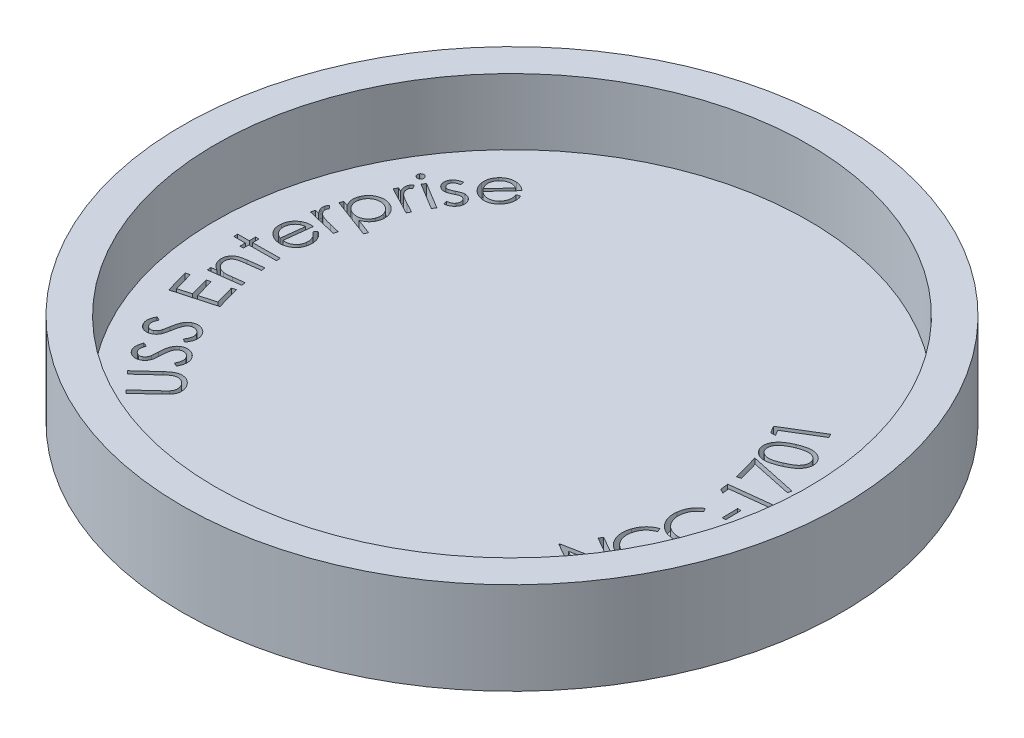
from build123d import *

# Parameters (mm, degrees)
SKETCH1_R           = 50
BOSS_EXTRUDE1_DEPTH = 4
SKETCH2_R           = 50
SKETCH2_R_2         = 45
BOSS_EXTRUDE2_DEPTH = 10
CUT_EXTRUDE3_DEPTH  = 2


with BuildPart() as part:
    # Sketch1 → Boss-Extrude1 (new body)
    with BuildSketch(Plane(origin=(0, 0, 0), x_dir=(1, 0, 0), z_dir=(0, 1, 0))):
        with Locations(Location((0, 0, 0), (0, 0, 270))):
            Circle(SKETCH1_R)
    extrude(amount=BOSS_EXTRUDE1_DEPTH)

    # Sketch2 → Boss-Extrude2 (add)
    with BuildSketch(Plane(origin=(0, 4, 0), x_dir=(1, 0, 0), z_dir=(0, 1, 0))):
        with Locations(Location((0, 0, 0), (0, 0, 270))):
            Circle(SKETCH2_R)
        with Locations(Location((0, 0, 0), (0, 0, 270))):
            Circle(SKETCH2_R_2, mode=Mode.SUBTRACT)
    extrude(amount=BOSS_EXTRUDE2_DEPTH)

    # Sketch9 → Cut-Extrude3 (cut)
    # profile 1 of 22: a face of its own
    with BuildSketch(Plane(origin=(0, 4, 0), x_dir=(1, 0, 0), z_dir=(0, 1, 0))):
        Polygon((24.998499088, 14.25952032), (24.356121284, 15.316581619), (29.735558383, 18.586984263), (30.061199409, 18.052729455), (25.208384906, 15.102879695), (25.721015114, 14.258248285), align=None)
    # profile 2 of 22: a face of its own
    with BuildSketch(Plane(origin=(0, 4, 0), x_dir=(1, 0, 0), z_dir=(0, 1, 0))):
        with BuildLine():
            add(Edge.make_bspline(
                [(30.153567453, 10.666011195), (30.06051733, 10.626848965), (29.879637003, 10.550721424), (29.612602404, 10.449468333), (29.359024137, 10.360439829), (29.117888931, 10.288023317), (28.889108349, 10.230311664), (28.673580133, 10.186472139), (28.470484461, 10.15817161), (28.279691377, 10.143808115), (28.098655401, 10.142475438), (27.925747213, 10.152677105), (27.759190676, 10.17306349), (27.599316542, 10.203270952), (27.446143784, 10.243805059), (27.300109637, 10.295431602), (27.159883116, 10.355616505), (27.027840787, 10.428864649), (26.90308151, 10.509853266), (26.787389063, 10.599705603), (26.67807229, 10.69477841), (26.579048059, 10.799604508), (26.48833778, 10.911814591), (26.406786455, 11.031851404), (26.333825666, 11.159572474), (26.292302708, 11.249131162), (26.27131585, 11.294396612)],
                knots=[0, 0, 0, 0, 1.643019788, 3.193869562, 4.647418308, 6.016378729, 7.290129949, 8.486566393, 9.594309651, 10.625385451, 11.598477842, 12.538662215, 13.442586513, 14.327770181, 15.184852529, 16.018612363, 16.846870285, 17.665323597, 18.473087284, 19.265402911, 20.047707011, 20.82873159, 21.609054591, 22.393850788, 23.188207541, 24, 24, 24, 24], degree=3))
            add(Edge.make_bspline(
                [(26.27131585, 11.294396612), (26.252468438, 11.341230871), (26.21504221, 11.434231946), (26.170127454, 11.576838172), (26.138531488, 11.721220169), (26.118046587, 11.866239842), (26.10922832, 12.012110851), (26.111253446, 12.158944189), (26.127655352, 12.306725766), (26.152274623, 12.455803248), (26.190501926, 12.604352255), (26.241854547, 12.751428813), (26.305754859, 12.896824299), (26.38249451, 13.040820629), (26.471510411, 13.183377257), (26.574064658, 13.323623159), (26.688888605, 13.462390282), (26.816710633, 13.60039267), (26.959050034, 13.737376666), (27.120741456, 13.868971417), (27.297992153, 14.000376882), (27.492418076, 14.13016093), (27.705604557, 14.255836533), (27.936236441, 14.378460872), (28.182982053, 14.501471764), (28.355436612, 14.577784034), (28.443952068, 14.616952702)],
                knots=[0, 0, 0, 0, 0.815621786, 1.619620016, 2.412594184, 3.20135369, 3.983928626, 4.772003355, 5.571052234, 6.384339509, 7.211932216, 8.046191876, 8.899122478, 9.775749728, 10.68070462, 11.612648492, 12.58117721, 13.589670971, 14.650990535, 15.770414115, 16.955793175, 18.215721225, 19.54592128, 20.952958848, 22.436050396, 24, 24, 24, 24], degree=3))
            add(Edge.make_bspline(
                [(28.443952068, 14.616952702), (28.532744894, 14.654457876), (28.705844517, 14.727573372), (28.963026804, 14.824178691), (29.209889745, 14.907131279), (29.446026203, 14.976508166), (29.672533056, 15.029755089), (29.887911444, 15.071466622), (30.093614306, 15.096987987), (30.289089273, 15.108825249), (30.475996537, 15.107074258), (30.655258837, 15.09602718), (30.827337752, 15.074428475), (30.992441583, 15.042970364), (31.150091253, 14.999577416), (31.300641954, 14.946119621), (31.443985185, 14.882695145), (31.578762218, 14.807220189), (31.705448973, 14.722780166), (31.826139833, 14.633439884), (31.935076933, 14.533284347), (32.036686596, 14.427025305), (32.129742682, 14.313061256), (32.211622327, 14.189798981), (32.288652161, 14.061521473), (32.329656368, 13.969954545), (32.350372341, 13.923693487)],
                knots=[0, 0, 0, 0, 1.558284236, 3.037840181, 4.440448624, 5.768199997, 7.015295516, 8.201177503, 9.313377377, 10.364063891, 11.364973115, 12.333549051, 13.266334535, 14.167132751, 15.048575983, 15.907224531, 16.74806443, 17.579715775, 18.401103814, 19.208672449, 20.004605603, 20.79013784, 21.584563907, 22.37934484, 23.181219413, 24, 24, 24, 24], degree=3))
            add(Edge.make_bspline(
                [(32.350372341, 13.923693487), (32.369485824, 13.877794651), (32.407332444, 13.786910337), (32.44829475, 13.645874355), (32.480547305, 13.504980511), (32.501669334, 13.362514347), (32.508143407, 13.219498121), (32.506701926, 13.075260368), (32.490256079, 12.930847711), (32.46568128, 12.78511942), (32.42701299, 12.64067357), (32.377694086, 12.49743852), (32.314226798, 12.356631827), (32.239544886, 12.216885542), (32.151381415, 12.079185523), (32.050079392, 11.944416863), (31.937841349, 11.810400914), (31.812962629, 11.677438408), (31.671287544, 11.546216035), (31.510911144, 11.417465353), (31.332117458, 11.288225694), (31.133526667, 11.162042622), (30.916245045, 11.0356323), (30.679833441, 10.910189569), (30.424053108, 10.785331165), (30.245431565, 10.706535426), (30.153567453, 10.666011195)],
                knots=[0, 0, 0, 0, 0.809649209, 1.603186903, 2.389380366, 3.164288389, 3.946188759, 4.720202877, 5.512265117, 6.312005813, 7.126534773, 7.946001823, 8.778073239, 9.640573611, 10.526126117, 11.43959776, 12.386231968, 13.373623722, 14.410176659, 15.530321822, 16.723147682, 18.003520593, 19.362843766, 20.818766876, 22.363908681, 24, 24, 24, 24], degree=3))
        make_face()
        with BuildLine():
            add(Edge.make_bspline(
                [(29.928417213, 11.218074496), (30.007466299, 11.252863476), (30.160467819, 11.320198433), (30.379913026, 11.424690847), (30.581877258, 11.528574705), (30.766192448, 11.631653826), (30.933963082, 11.732075337), (31.084449233, 11.831888615), (31.21642937, 11.932897664), (31.334319149, 12.031072869), (31.436416421, 12.13169577), (31.529011899, 12.232077355), (31.610064364, 12.335675153), (31.683460961, 12.439856418), (31.745973405, 12.547101594), (31.798239387, 12.656484458), (31.840147994, 12.767727232), (31.884107707, 12.915105198), (31.914674433, 13.099174992), (31.922070833, 13.315421622), (31.890182289, 13.523787538), (31.842515742, 13.652973996), (31.818661604, 13.717623775)],
                knots=[0, 0, 0, 0, 1.479246193, 2.863118684, 4.162401901, 5.368657324, 6.479676105, 7.510997497, 8.45951694, 9.325265847, 10.136734584, 10.913022843, 11.662765802, 12.388049343, 13.094320723, 13.786256968, 14.46203443, 15.128458936, 16.417962244, 17.645693268, 18.821816047, 20, 20, 20, 20], degree=3))
            add(Edge.make_bspline(
                [(31.818661604, 13.717623775), (31.788202172, 13.780004458), (31.727444228, 13.904436264), (31.596370805, 14.06831338), (31.439063076, 14.2132853), (31.284947201, 14.313148368), (31.150064766, 14.382215554), (31.041177429, 14.425079984), (30.927489153, 14.461337931), (30.807411945, 14.4877794), (30.68152156, 14.505548142), (30.549742097, 14.513801145), (30.412511998, 14.515781753), (30.319334777, 14.509490592), (30.271866732, 14.506285634)],
                knots=[0, 0, 0, 0, 1.340846824, 2.674609907, 4.034505117, 5.469287384, 6.214747957, 6.966468284, 7.732581159, 8.523463998, 9.344464116, 10.192172018, 11.079023192, 12, 12, 12, 12], degree=3))
            add(Edge.make_bspline(
                [(30.271866732, 14.506285634), (30.211578466, 14.501026321), (30.089324123, 14.490361328), (29.903919334, 14.461293879), (29.713695467, 14.423495663), (29.51820727, 14.374434509), (29.317800095, 14.316272042), (29.112610068, 14.24700074), (28.902485605, 14.168348759), (28.762180246, 14.109070459), (28.690726908, 14.078881788)],
                knots=[0, 0, 0, 0, 0.882475608, 1.789510373, 2.735577064, 3.710573961, 4.72831703, 5.778557772, 6.868685688, 8, 8, 8, 8], degree=3))
            add(Edge.make_bspline(
                [(28.690726908, 14.078881788), (28.619708137, 14.047537792), (28.481371579, 13.986483224), (28.28196379, 13.889308834), (28.095157173, 13.789944718), (27.919825222, 13.690299232), (27.757252188, 13.588019029), (27.607506743, 13.483932469), (27.469189718, 13.378693543), (27.345087401, 13.26993368), (27.230948777, 13.162448368), (27.130138743, 13.052124227), (27.040313532, 12.941995098), (26.95977821, 12.832067798), (26.893229138, 12.720396327), (26.836129876, 12.609025436), (26.791232377, 12.496621152), (26.748559917, 12.348151413), (26.716447672, 12.165608116), (26.712198201, 11.951132474), (26.740814042, 11.744514371), (26.789146392, 11.616390771), (26.81320287, 11.552619769)],
                knots=[0, 0, 0, 0, 1.330309585, 2.591293041, 3.800566693, 4.956069664, 6.046782804, 7.090970529, 8.080768729, 9.023458388, 9.91776937, 10.766361516, 11.582374616, 12.352786092, 13.099282215, 13.807742726, 14.495937864, 15.169710006, 16.452778332, 17.659254052, 18.834939732, 20, 20, 20, 20], degree=3))
            add(Edge.make_bspline(
                [(26.81320287, 11.552619769), (26.843577919, 11.49017494), (26.904282417, 11.365379024), (27.037246156, 11.201838206), (27.195355489, 11.055850863), (27.350265904, 10.954049605), (27.487237984, 10.88586328), (27.596718169, 10.84087117), (27.711865215, 10.805720254), (27.831981104, 10.777187546), (27.957937922, 10.758418619), (28.089302432, 10.748595946), (28.226030641, 10.746351483), (28.369727032, 10.750699395), (28.522249643, 10.768075836), (28.685992202, 10.796870039), (28.862987142, 10.835700526), (29.051523365, 10.890612019), (29.253504933, 10.953609344), (29.4671393, 11.031232334), (29.694668288, 11.117916875), (29.848930651, 11.184015794), (29.928417213, 11.218074496)],
                knots=[0, 0, 0, 0, 1.185857748, 2.369935262, 3.582900449, 4.861895009, 5.52767488, 6.201955417, 6.886443791, 7.58752731, 8.314680061, 9.064928424, 9.842108094, 10.655981057, 11.525311517, 12.468489377, 13.502719518, 14.626937476, 15.830430831, 17.125936102, 18.519084924, 20, 20, 20, 20], degree=3))
        make_face(mode=Mode.SUBTRACT)
    # profile 3 of 22: a face of its own
    with BuildSketch(Plane(origin=(0, 4, 0), x_dir=(1, 0, 0), z_dir=(0, 1, 0))):
        Polygon((28.202048831, 5.865532973), (27.124634969, 9.72234387), (34.267112933, 8.208621915), (34.151357725, 7.637478085), (27.962906203, 8.941314223), (28.777008767, 6.02708145), align=None)
    # profile 4 of 22: a face of its own
    with BuildSketch(Plane(origin=(0, 4, 0), x_dir=(1, 0, 0), z_dir=(0, 1, 0))):
        Polygon((28.640122951, 3.003054064), (28.498927038, 4.233112157), (34.756068464, 4.956900217), (34.827302438, 4.334874977), (29.183282005, 3.682320891), (29.296493143, 2.700309673), align=None)
    # profile 5 of 22: a face of its own
    with BuildSketch(Plane(origin=(0, 4, 0), x_dir=(1, 0, 0), z_dir=(0, 1, 0))):
        Polygon((32.496543252, -0.588755809), (32.448205912, 1.773413662), (32.971012402, 1.783589944), (33.019349742, -0.578579527), align=None)
    # profile 6 of 22: a face of its own
    with BuildSketch(Plane(origin=(0, 4, 0), x_dir=(1, 0, 0), z_dir=(0, 1, 0))):
        with BuildLine():
            Line((29.981962847, -0.680639502), (30.298699626, -1.221254486))
            add(Edge.make_bspline(
                [(30.298699626, -1.221254486), (30.250732943, -1.249778782), (30.155716111, -1.30628234), (30.022598317, -1.403259544), (29.894747159, -1.503595684), (29.773695818, -1.609795101), (29.662102983, -1.724137145), (29.555288579, -1.84217932), (29.458127567, -1.968305341), (29.367476434, -2.099392475), (29.284827987, -2.235822402), (29.209296805, -2.376888801), (29.143804864, -2.523534007), (29.084449943, -2.673848804), (29.035452293, -2.829250622), (28.993338976, -2.988824774), (28.958271439, -3.152987399), (28.942861118, -3.264874104), (28.935077831, -3.321384694)],
                knots=[0, 0, 0, 0, 1.03044874, 2.041207956, 3.039475552, 4.032813705, 5.013219321, 5.989642655, 6.972080202, 7.952016313, 8.932703525, 9.917386931, 10.906019349, 11.89809039, 12.901385529, 13.914085482, 14.946467663, 16, 16, 16, 16], degree=3))
            add(Edge.make_bspline(
                [(28.935077831, -3.321384694), (28.928380713, -3.383226088), (28.915058782, -3.506241206), (28.908651901, -3.691149308), (28.915764274, -3.873749773), (28.931436972, -4.054491393), (28.961389055, -4.232832915), (29.001875192, -4.409628212), (29.054183645, -4.584261839), (29.117763102, -4.755356282), (29.190940551, -4.92184632), (29.275066861, -5.080341951), (29.367275915, -5.231543669), (29.467281497, -5.375247712), (29.576872204, -5.510549414), (29.696332736, -5.636755574), (29.822934224, -5.756684688), (29.959405937, -5.86708644), (30.10290636, -5.968802952), (30.252745797, -6.060578438), (30.409268635, -6.140606469), (30.570537825, -6.212614444), (30.739217831, -6.272032765), (30.913824292, -6.321643281), (31.09436009, -6.36142464), (31.217402265, -6.379266183), (31.279438809, -6.388261697)],
                knots=[0, 0, 0, 0, 1.039712622, 2.068200013, 3.089602841, 4.093363362, 5.099099422, 6.110217252, 7.1239409, 8.144457777, 9.160038631, 10.162070494, 11.141967742, 12.11934894, 13.08696409, 14.049841742, 15.022739634, 16.000326467, 16.981786571, 17.961683819, 18.935020646, 19.918935299, 20.912202867, 21.921953061, 22.952271045, 24, 24, 24, 24], degree=3))
            add(Edge.make_bspline(
                [(31.279438809, -6.388261697), (31.373040332, -6.397650625), (31.557405544, -6.416143825), (31.831497315, -6.413259308), (32.096908171, -6.383875714), (32.35352843, -6.32912919), (32.601962157, -6.248883303), (32.841345645, -6.140833173), (33.071909113, -6.006965866), (33.290711024, -5.848121966), (33.49491002, -5.669932219), (33.679249571, -5.473518953), (33.839858667, -5.259680259), (33.979343041, -5.031205444), (34.095893709, -4.786567509), (34.187968001, -4.525799514), (34.260570408, -4.249701408), (34.289555002, -4.058659639), (34.304338649, -3.961218428)],
                knots=[0, 0, 0, 0, 1.040528935, 2.049510867, 3.026885138, 3.9914679, 4.948659554, 5.910670472, 6.892630425, 7.894219084, 8.898530412, 9.887930154, 10.869654601, 11.853138363, 12.845982056, 13.862747579, 14.909890414, 16, 16, 16, 16], degree=3))
            add(Edge.make_bspline(
                [(34.304338649, -3.961218428), (34.314728797, -3.853205745), (34.335159335, -3.64081634), (34.325315749, -3.324140261), (34.282640258, -3.017198599), (34.203846993, -2.720008036), (34.092840078, -2.431632097), (33.945846352, -2.153607737), (33.768170111, -1.882727814), (33.625323669, -1.716691389), (33.552565812, -1.632121874)],
                knots=[0, 0, 0, 0, 1.028785935, 2.022940521, 2.99817432, 3.963305686, 4.933864232, 5.923629233, 6.942414783, 8, 8, 8, 8], degree=3))
            Line((33.552565812, -1.632121874), (33.988873905, -1.186909534))
            add(Edge.make_bspline(
                [(33.988873905, -1.186909534), (34.032754824, -1.232556627), (34.120068375, -1.323384484), (34.239485881, -1.469420974), (34.349937158, -1.620824949), (34.452917508, -1.777523203), (34.543572323, -1.941942178), (34.62715094, -2.111847304), (34.700537641, -2.288178833), (34.764259024, -2.470381801), (34.817533972, -2.657320738), (34.86075577, -2.848425788), (34.894132376, -3.043249188), (34.915744057, -3.242058826), (34.925436205, -3.445073984), (34.925756603, -3.651836798), (34.914197777, -3.862434269), (34.898620008, -4.003256896), (34.890746902, -4.074429566)],
                knots=[0, 0, 0, 0, 0.969299437, 1.92869654, 2.885849848, 3.838566093, 4.797809377, 5.759006518, 6.736966386, 7.720600368, 8.713279452, 9.711950126, 10.719635527, 11.738554762, 12.772262553, 13.830636756, 14.903589721, 16, 16, 16, 16], degree=3))
            add(Edge.make_bspline(
                [(34.890746902, -4.074429566), (34.881700419, -4.141959771), (34.863819182, -4.275439673), (34.825120745, -4.470996128), (34.779140308, -4.66024068), (34.726218639, -4.842953947), (34.664789678, -5.019037004), (34.596436792, -5.18883211), (34.51845867, -5.351598508), (34.433259909, -5.508365616), (34.340251754, -5.658697359), (34.2396668, -5.802722041), (34.131228181, -5.940183498), (34.015823043, -6.071948025), (33.889960419, -6.19498904), (33.758374116, -6.313588246), (33.617954492, -6.42463131), (33.519451045, -6.492674034), (33.46988352, -6.52691354)],
                knots=[0, 0, 0, 0, 1.116340882, 2.206554415, 3.264947076, 4.307250313, 5.322520011, 6.319965422, 7.30523453, 8.278497482, 9.242663971, 10.200726568, 11.15573523, 12.110769171, 13.068907362, 14.038367667, 15.012894872, 16, 16, 16, 16], degree=3))
            add(Edge.make_bspline(
                [(33.46988352, -6.52691354), (33.384399935, -6.580878695), (33.214491577, -6.688140583), (32.943057698, -6.816132294), (32.664769082, -6.922923469), (32.375958134, -6.997402581), (32.079760199, -7.051511002), (31.773876829, -7.073900658), (31.459331832, -7.074257657), (31.247946515, -7.052065741), (31.140786966, -7.040815784)],
                knots=[0, 0, 0, 0, 0.994352422, 1.976388633, 2.948617253, 3.924673629, 4.908101674, 5.908890554, 6.939934195, 8, 8, 8, 8], degree=3))
            add(Edge.make_bspline(
                [(31.140786966, -7.040815784), (31.028825748, -7.023989697), (30.808150691, -6.990825554), (30.489570296, -6.902945896), (30.188316251, -6.788060401), (29.904012523, -6.645048506), (29.6372931, -6.472478423), (29.38800767, -6.271600212), (29.156860606, -6.042490931), (28.945995949, -5.78790334), (28.758054862, -5.513976853), (28.601523721, -5.223981422), (28.474519339, -4.923384443), (28.378339766, -4.611152312), (28.314843144, -4.287079958), (28.283934734, -3.951405753), (28.281212281, -3.60464875), (28.305698054, -3.37128221), (28.318140732, -3.25269479)],
                knots=[0, 0, 0, 0, 1.029343047, 2.028830514, 2.999622175, 3.958870473, 4.918723657, 5.884512413, 6.866560249, 7.874691307, 8.887998098, 9.884010114, 10.8677538, 11.852518128, 12.851201202, 13.866532789, 14.91585841, 16, 16, 16, 16], degree=3))
            add(Edge.make_bspline(
                [(28.318140732, -3.25269479), (28.328500904, -3.180505738), (28.34893874, -3.038096127), (28.390795844, -2.828511083), (28.44445397, -2.626056014), (28.508206339, -2.430483914), (28.580252608, -2.240882424), (28.665106847, -2.059401129), (28.757404124, -1.88270819), (28.862155056, -1.714283324), (28.974482954, -1.552808241), (29.096587494, -1.40155189), (29.222909475, -1.256655271), (29.359898624, -1.123341389), (29.50379236, -0.998361893), (29.655132518, -0.882332318), (29.814940988, -0.776378852), (29.926054981, -0.712686701), (29.981962847, -0.680639502)],
                knots=[0, 0, 0, 0, 1.099055363, 2.16814103, 3.21911835, 4.253862704, 5.267411697, 6.273924879, 7.271634925, 8.270163337, 9.261240324, 10.234352187, 11.198673642, 12.156727755, 13.112626656, 14.069998455, 15.028904777, 16, 16, 16, 16], degree=3))
        make_face()
    # profile 7 of 22: a face of its own
    with BuildSketch(Plane(origin=(0, 4, 0), x_dir=(1, 0, 0), z_dir=(0, 1, 0))):
        with BuildLine():
            Line((29.214609936, -6.747610999), (29.415591507, -7.339107393))
            add(Edge.make_bspline(
                [(29.415591507, -7.339107393), (29.363275516, -7.358174373), (29.259381373, -7.396039421), (29.107745863, -7.460044802), (28.96391829, -7.535121849), (28.824625084, -7.614974594), (28.691067373, -7.702665373), (28.563629761, -7.798257995), (28.442485785, -7.901445975), (28.290024376, -8.04943275), (28.113757572, -8.249919824), (27.93274875, -8.517690339), (27.776389289, -8.808146565), (27.699291807, -9.016705769), (27.660182853, -9.122500822)],
                knots=[0, 0, 0, 0, 0.772111615, 1.533333743, 2.280136742, 3.02036067, 3.759088628, 4.494039821, 5.228073223, 5.9640585, 7.439196175, 8.919970907, 10.437605081, 12, 12, 12, 12], degree=3))
            add(Edge.make_bspline(
                [(27.660182853, -9.122500822), (27.641202278, -9.181644154), (27.603424305, -9.29936004), (27.560362528, -9.478703002), (27.529965689, -9.65852888), (27.510645831, -9.83865304), (27.503196276, -10.019218884), (27.506538197, -10.20028227), (27.523652066, -10.381230628), (27.551341046, -10.561409558), (27.590616555, -10.738555322), (27.640488074, -10.910984845), (27.699742617, -11.077387544), (27.770415985, -11.237384156), (27.850775043, -11.391575898), (27.940519494, -11.540408458), (28.042098366, -11.682205308), (28.152342032, -11.817888474), (28.271311927, -11.946760044), (28.40101373, -12.06472906), (28.536914774, -12.176360617), (28.682196605, -12.27719551), (28.833788262, -12.371481183), (28.995079269, -12.453061575), (29.162995963, -12.529472378), (29.280002731, -12.571383858), (29.339269392, -12.592613002)],
                knots=[0, 0, 0, 0, 1.039710462, 2.069386943, 3.084769883, 4.091404193, 5.100388878, 6.108699016, 7.120999908, 8.141111976, 9.159072663, 10.156654322, 11.144692441, 12.114193544, 13.08265441, 14.054232647, 15.021443751, 16.000463181, 16.979971535, 17.954657173, 18.933676603, 19.922377612, 20.913471526, 21.919980662, 22.946421625, 24, 24, 24, 24], degree=3))
            add(Edge.make_bspline(
                [(29.339269392, -12.592613002), (29.429123524, -12.620642478), (29.605642064, -12.675706414), (29.874683269, -12.727354909), (30.139998524, -12.753736894), (30.402781065, -12.75140346), (30.661733821, -12.719935667), (30.917833798, -12.664436614), (31.170022163, -12.5792767), (31.415865135, -12.467761749), (31.651862285, -12.333892108), (31.871178445, -12.178182176), (32.072904829, -12.00313731), (32.25364714, -11.806142006), (32.415743024, -11.589718733), (32.560550583, -11.354294479), (32.68542441, -11.097882591), (32.752399005, -10.916696515), (32.786484936, -10.824483995)],
                knots=[0, 0, 0, 0, 1.042059573, 2.047127153, 3.028681581, 3.991683508, 4.951886004, 5.913821895, 6.889751516, 7.894687366, 8.900314613, 9.890864667, 10.869650184, 11.853629426, 12.84664899, 13.86093877, 14.911349969, 16, 16, 16, 16], degree=3))
            add(Edge.make_bspline(
                [(32.786484936, -10.824483995), (32.818579445, -10.721211505), (32.881859618, -10.51759097), (32.933874755, -10.205563454), (32.953745184, -9.896497069), (32.939125329, -9.589383814), (32.885695103, -9.284847977), (32.798128783, -8.983231467), (32.677695675, -8.683072729), (32.571133167, -8.492195412), (32.516813462, -8.394896656)],
                knots=[0, 0, 0, 0, 1.026191736, 2.023324005, 2.995800601, 3.963579093, 4.936214125, 5.925343729, 6.942454365, 8, 8, 8, 8], degree=3))
            Line((32.516813462, -8.394896656), (33.034531811, -8.046358995))
            add(Edge.make_bspline(
                [(33.034531811, -8.046358995), (33.068396009, -8.09974518), (33.135901855, -8.206166705), (33.222575334, -8.373243967), (33.30063143, -8.543473851), (33.370451477, -8.717270034), (33.42510166, -8.897424084), (33.472750226, -9.080570185), (33.509930573, -9.267801761), (33.534778338, -9.458639531), (33.550466156, -9.652217276), (33.554241001, -9.848055591), (33.546020988, -10.045452429), (33.528999701, -10.244358527), (33.497769329, -10.444703917), (33.455317267, -10.646550325), (33.40423832, -10.850912352), (33.359761781, -10.985438995), (33.337276203, -11.053450342)],
                knots=[0, 0, 0, 0, 0.968683775, 1.931001542, 2.882015194, 3.839116988, 4.799127378, 5.765453405, 6.73929112, 7.722840477, 8.713834912, 9.714944286, 10.723117731, 11.741110974, 12.773382635, 13.828822472, 14.902338567, 16, 16, 16, 16], degree=3))
            add(Edge.make_bspline(
                [(33.337276203, -11.053450342), (33.314577818, -11.117712325), (33.269845554, -11.244354994), (33.192825665, -11.427917799), (33.110309274, -11.603754456), (33.021124509, -11.771835024), (32.926157545, -11.932253865), (32.823465337, -12.084149502), (32.716363127, -12.228626408), (32.60197022, -12.365270254), (32.479956538, -12.492575286), (32.353096194, -12.614207168), (32.218779709, -12.72618662), (32.078713301, -12.830753592), (31.932120932, -12.927469531), (31.779529246, -13.016755513), (31.620069962, -13.097184009), (31.510055402, -13.144000992), (31.454664023, -13.167572938)],
                knots=[0, 0, 0, 0, 1.118207173, 2.203678356, 3.265086854, 4.304719018, 5.325007608, 6.322744008, 7.312196656, 8.275265758, 9.244848252, 10.204593639, 11.157859999, 12.112522046, 13.071661883, 14.038318782, 15.012310473, 16, 16, 16, 16], degree=3))
            add(Edge.make_bspline(
                [(31.454664023, -13.167572938), (31.359840092, -13.202855739), (31.171466422, -13.272947232), (30.880303128, -13.345949407), (30.586136464, -13.392554176), (30.288399582, -13.40974357), (29.9873607, -13.401221843), (29.683100802, -13.363405967), (29.375684982, -13.299041915), (29.173433402, -13.235441978), (29.070869953, -13.203189925)],
                knots=[0, 0, 0, 0, 0.995894655, 1.978407025, 2.950640742, 3.925463228, 4.911492984, 5.912793244, 6.941560195, 8, 8, 8, 8], degree=3))
            add(Edge.make_bspline(
                [(29.070869953, -13.203189925), (28.964871958, -13.164072739), (28.755982769, -13.086984891), (28.461577512, -12.938309926), (28.189340818, -12.765754536), (27.940923574, -12.567703449), (27.713562878, -12.346535409), (27.511356127, -12.099579953), (27.33053589, -11.829390219), (27.175953806, -11.537491755), (27.04778284, -11.231056931), (26.950048144, -10.916492627), (26.887981313, -10.596089211), (26.856921429, -10.271470435), (26.859664969, -9.941532178), (26.896716591, -9.60707516), (26.96267802, -9.26658036), (27.033753758, -9.043026093), (27.069958494, -8.929151463)],
                knots=[0, 0, 0, 0, 1.028379162, 2.026616534, 2.997221121, 3.959190463, 4.915000849, 5.880683775, 6.860715232, 7.871372543, 8.884056808, 9.882055113, 10.865875987, 11.851143462, 12.847519084, 13.865073553, 14.912505843, 16, 16, 16, 16], degree=3))
            add(Edge.make_bspline(
                [(27.069958494, -8.929151463), (27.094213843, -8.860595091), (27.142169598, -8.725050864), (27.226592866, -8.528941392), (27.319668989, -8.341964331), (27.420124983, -8.16255347), (27.530943165, -7.992729576), (27.649312314, -7.830862026), (27.775746019, -7.677006919), (27.911378655, -7.53307768), (28.053898566, -7.397780215), (28.202971299, -7.273411864), (28.356803921, -7.158014194), (28.517660084, -7.055365122), (28.68320263, -6.96214608), (28.854372423, -6.879318616), (29.031121316, -6.805820965), (29.153237328, -6.767080857), (29.214609936, -6.747610999)],
                knots=[0, 0, 0, 0, 1.097208456, 2.169313618, 3.219541112, 4.248162067, 5.270474364, 6.277716381, 7.2731616, 8.273612387, 9.26036125, 10.236953835, 11.201905342, 12.160385448, 13.114412463, 14.067408885, 15.02872559, 16, 16, 16, 16], degree=3))
        make_face()
    # profile 8 of 22: a face of its own
    with BuildSketch(Plane(origin=(0, 4, 0), x_dir=(1, 0, 0), z_dir=(0, 1, 0))):
        Polygon((29.072788351, -19.640463837), (23.576324008, -16.465463837), (23.645013912, -16.345892523), (29.963213031, -15.122194606), (25.755320402, -12.691335231), (26.068241075, -12.149448212), (31.564705418, -15.324448212), (31.493471444, -15.447835632), (25.243962229, -16.672805584), (29.399701412, -19.073136112), align=None)
    # profile 9 of 22: a face of its own
    with BuildSketch(Plane(origin=(0, 4, 0), x_dir=(1, 0, 0), z_dir=(0, 1, 0))):
        with BuildLine():
            Line((-29.104194688, -29.484703058), (-29.53287057, -29.016594083))
            Line((-29.53287057, -29.016594083), (-26.7089523, -26.428002337))
            add(Edge.make_bspline(
                [(-26.7089523, -26.428002337), (-26.668919228, -26.391726187), (-26.592652702, -26.322616929), (-26.486875747, -26.221371182), (-26.390352905, -26.133546153), (-26.309691668, -26.052581018), (-26.239475254, -25.983752606), (-26.180210275, -25.926310026), (-26.136195552, -25.876232531), (-26.110655906, -25.846694019), (-26.099647413, -25.833961872)],
                knots=[0, 0, 0, 0, 1.522735973, 2.900946063, 4.127113117, 5.200461673, 6.121692298, 6.899212031, 7.525521326, 8, 8, 8, 8], degree=3))
            add(Edge.make_bspline(
                [(-26.099647413, -25.833961872), (-26.06123546, -25.786431904), (-25.987142261, -25.694750877), (-25.896930297, -25.547829388), (-25.829202763, -25.399978937), (-25.781237772, -25.249443323), (-25.758367254, -25.092326141), (-25.759209611, -24.92667548), (-25.782652613, -24.751003681), (-25.830363677, -24.569898585), (-25.894370297, -24.390065127), (-25.976827758, -24.220489979), (-26.073626526, -24.063649539), (-26.153077429, -23.971593172), (-26.192505986, -23.925908987)],
                knots=[0, 0, 0, 0, 1.046023926, 2.017685947, 2.944012848, 3.826203993, 4.714741168, 5.651713901, 6.655345505, 7.742279268, 8.854308096, 9.919820172, 10.967683362, 12, 12, 12, 12], degree=3))
            add(Edge.make_bspline(
                [(-26.192505986, -23.925908987), (-26.228962379, -23.888493285), (-26.301513379, -23.814033184), (-26.42539082, -23.719450986), (-26.556557645, -23.634707793), (-26.699134979, -23.569379006), (-26.845220806, -23.514574688), (-26.99591757, -23.480730865), (-27.147667032, -23.462372232), (-27.301011393, -23.462354431), (-27.454801057, -23.481112096), (-27.609789775, -23.514643041), (-27.764037367, -23.570462075), (-27.863947977, -23.618862388), (-27.914841724, -23.64351716)],
                knots=[0, 0, 0, 0, 0.99741108, 1.984924106, 2.972204217, 3.976606926, 4.976649702, 5.949987886, 6.921264877, 7.893995295, 8.873323309, 9.87828194, 10.919212068, 12, 12, 12, 12], degree=3))
            add(Edge.make_bspline(
                [(-27.914841724, -23.64351716), (-27.935369545, -23.654671735), (-27.980915451, -23.679420841), (-28.051788246, -23.727409809), (-28.132768377, -23.787419197), (-28.224713875, -23.858706119), (-28.326383989, -23.943341271), (-28.4390491, -24.039267849), (-28.561640839, -24.148267002), (-28.646336257, -24.225179694), (-28.69078323, -24.265542401)],
                knots=[0, 0, 0, 0, 0.562413861, 1.24785033, 2.058741098, 2.990238125, 4.049358218, 5.244536074, 6.553971013, 8, 8, 8, 8], degree=3))
            Line((-28.69078323, -24.265542401), (-31.514701499, -26.854134148))
            Line((-31.514701499, -26.854134148), (-31.942105345, -26.387297208))
            Line((-31.942105345, -26.387297208), (-29.118187076, -23.798705462))
            add(Edge.make_bspline(
                [(-29.118187076, -23.798705462), (-29.066717614, -23.752191975), (-28.966586943, -23.661702848), (-28.815806152, -23.534261944), (-28.669558575, -23.416495382), (-28.526474625, -23.310739462), (-28.388719433, -23.213794826), (-28.253643665, -23.130086667), (-28.122772967, -23.056588247), (-27.995700879, -22.990799052), (-27.867397357, -22.938703449), (-27.736597992, -22.895995604), (-27.601652919, -22.864560683), (-27.463098614, -22.842550801), (-27.320543332, -22.83278376), (-27.174354552, -22.832929639), (-27.023835161, -22.84295185), (-26.870826779, -22.864726659), (-26.717807751, -22.89688936), (-26.568469088, -22.943056753), (-26.423435098, -23.001626104), (-26.28391567, -23.075192845), (-26.14690297, -23.158243371), (-26.016672239, -23.257782168), (-25.890813814, -23.369635892), (-25.811640244, -23.451747909), (-25.771462317, -23.493417)],
                knots=[0, 0, 0, 0, 1.30549502, 2.539760243, 3.714959098, 4.838524076, 5.887768169, 6.884188335, 7.82745921, 8.712496979, 9.574942374, 10.430419297, 11.299484274, 12.179796807, 13.067851269, 13.985527401, 14.92930444, 15.904342345, 16.891936365, 17.86876857, 18.842335952, 19.830961065, 20.83416412, 21.853986589, 22.910970269, 24, 24, 24, 24], degree=3))
            add(Edge.make_bspline(
                [(-25.771462317, -23.493417), (-25.729524969, -23.540246033), (-25.646942457, -23.632461191), (-25.538840276, -23.780027836), (-25.439146204, -23.927160983), (-25.355732261, -24.078647855), (-25.284875006, -24.232462559), (-25.227726914, -24.389087573), (-25.182923417, -24.548541797), (-25.151418411, -24.709789524), (-25.131869119, -24.870506307), (-25.127110048, -25.028810181), (-25.134159944, -25.183789201), (-25.156162005, -25.335262806), (-25.190645931, -25.483788777), (-25.2379559, -25.628836002), (-25.297181302, -25.77123944), (-25.347795152, -25.861139274), (-25.373315281, -25.906467882)],
                knots=[0, 0, 0, 0, 1.148189524, 2.261000762, 3.339946351, 4.394459392, 5.417406161, 6.432367136, 7.438294435, 8.441352091, 9.432363463, 10.393785713, 11.332612102, 12.26415008, 13.187106747, 14.115900866, 15.050013935, 16, 16, 16, 16], degree=3))
            add(Edge.make_bspline(
                [(-25.373315281, -25.906467882), (-25.392037931, -25.936389169), (-25.432496003, -26.001046555), (-25.506007171, -26.100128676), (-25.594918353, -26.209399858), (-25.701332672, -26.327146798), (-25.822213231, -26.456052601), (-25.959977346, -26.594405474), (-26.113498697, -26.743294339), (-26.223198265, -26.843811096), (-26.280276419, -26.896111311)],
                knots=[0, 0, 0, 0, 0.629028697, 1.359278087, 2.19746813, 3.139700736, 4.18780633, 5.347677938, 6.619961328, 8, 8, 8, 8], degree=3))
            Line((-26.280276419, -26.896111311), (-29.104194688, -29.484703058))
        make_face()
    # profile 10 of 22: a face of its own
    with BuildSketch(Plane(origin=(0, 4, 0), x_dir=(1, 0, 0), z_dir=(0, 1, 0))):
        with BuildLine():
            Line((-28.820267285, -22.088179042), (-29.386322974, -21.826139779))
            add(Edge.make_bspline(
                [(-29.386322974, -21.826139779), (-29.344452619, -21.741618543), (-29.264205527, -21.579628433), (-29.174043227, -21.335647314), (-29.110948322, -21.106011124), (-29.079033678, -20.889347133), (-29.078162255, -20.686068139), (-29.1074103, -20.496737481), (-29.165076626, -20.319273822), (-29.228577927, -20.214705442), (-29.260391484, -20.162317664)],
                knots=[0, 0, 0, 0, 1.291081838, 2.474437168, 3.556284072, 4.547568894, 5.465126049, 6.329188696, 7.162939193, 8, 8, 8, 8], degree=3))
            add(Edge.make_bspline(
                [(-29.260391484, -20.162317664), (-29.29114504, -20.120310941), (-29.352226793, -20.036878499), (-29.461985444, -19.927761927), (-29.582080268, -19.830523803), (-29.714679098, -19.752030746), (-29.853240572, -19.689469658), (-29.994360963, -19.644724805), (-30.138267167, -19.62507716), (-30.281122942, -19.623393307), (-30.420893599, -19.64153165), (-30.55481591, -19.675991258), (-30.682259364, -19.727674274), (-30.759501116, -19.776530342), (-30.798282109, -19.801059651)],
                knots=[0, 0, 0, 0, 1.065800822, 2.116860357, 3.162153114, 4.226535138, 5.26533837, 6.274441125, 7.249267584, 8.231545153, 9.195420128, 10.129396193, 11.060820461, 12, 12, 12, 12], degree=3))
            add(Edge.make_bspline(
                [(-30.798282109, -19.801059651), (-30.840189447, -19.832790596), (-30.925060407, -19.897052272), (-31.032087132, -20.020413225), (-31.122386112, -20.165003426), (-31.166998935, -20.272232375), (-31.190068968, -20.327682247)],
                knots=[0, 0, 0, 0, 0.94418875, 1.91217599, 2.920351504, 4, 4, 4, 4], degree=3))
            add(Edge.make_bspline(
                [(-31.190068968, -20.327682247), (-31.205005137, -20.369916466), (-31.236511218, -20.459004556), (-31.275073115, -20.60233537), (-31.308833754, -20.761352338), (-31.341132594, -20.935500932), (-31.367429363, -21.126106676), (-31.388024069, -21.332430928), (-31.408124255, -21.553672573), (-31.416159653, -21.706531975), (-31.420307349, -21.785434651)],
                knots=[0, 0, 0, 0, 0.725744853, 1.530872945, 2.402860077, 3.359753143, 4.400477896, 5.519717038, 6.719732248, 8, 8, 8, 8], degree=3))
            add(Edge.make_bspline(
                [(-31.420307349, -21.785434651), (-31.424302149, -21.863889542), (-31.431950107, -22.014089745), (-31.446747649, -22.228728653), (-31.465518962, -22.421925925), (-31.481705294, -22.594444886), (-31.503885205, -22.745310799), (-31.526147039, -22.875746865), (-31.550612921, -22.9851197), (-31.571288179, -23.04994776), (-31.580583792, -23.079094507)],
                knots=[0, 0, 0, 0, 1.442819238, 2.76224642, 3.950980222, 5.007951662, 5.944091172, 6.750705688, 7.438316294, 8, 8, 8, 8], degree=3))
            add(Edge.make_bspline(
                [(-31.580583792, -23.079094507), (-31.596625605, -23.121691731), (-31.628314502, -23.205838026), (-31.683925918, -23.327287474), (-31.74920789, -23.440558295), (-31.821738971, -23.546646824), (-31.902565785, -23.645011932), (-31.990276794, -23.73676061), (-32.085774072, -23.821430424), (-32.155080581, -23.870897224), (-32.18988868, -23.895741141)],
                knots=[0, 0, 0, 0, 1.053325998, 2.080733668, 3.087356702, 4.075440683, 5.051759005, 6.030392574, 7.010795825, 8, 8, 8, 8], degree=3))
            add(Edge.make_bspline(
                [(-32.18988868, -23.895741141), (-32.246684, -23.931652492), (-32.358600996, -24.002416958), (-32.539890589, -24.080421861), (-32.727595636, -24.13125174), (-32.919492507, -24.158445174), (-33.112692944, -24.158720295), (-33.303719521, -24.130805158), (-33.491854076, -24.079415611), (-33.67295874, -23.997751865), (-33.84571226, -23.896279566), (-34.002696021, -23.770553646), (-34.148097227, -23.628474449), (-34.227945526, -23.51796029), (-34.268394289, -23.461977119)],
                knots=[0, 0, 0, 0, 1.020124895, 2.010188766, 2.985758271, 3.968242433, 4.947805489, 5.911144148, 6.894642313, 7.901675665, 8.92180056, 9.931305366, 10.952061104, 12, 12, 12, 12], degree=3))
            add(Edge.make_bspline(
                [(-34.268394289, -23.461977119), (-34.306938654, -23.400130588), (-34.383601306, -23.27712119), (-34.468855307, -23.077096173), (-34.526137983, -22.867295664), (-34.552843721, -22.685600847), (-34.56043273, -22.532966308), (-34.554067488, -22.410176914), (-34.541679705, -22.279749318), (-34.519613689, -22.142200953), (-34.488683594, -21.996692628), (-34.449361501, -21.843451437), (-34.400820699, -21.68266177), (-34.362935722, -21.574140237), (-34.343444369, -21.518307247)],
                knots=[0, 0, 0, 0, 1.291748531, 2.569217801, 3.841558035, 5.141890287, 5.819745318, 6.550222212, 7.321379844, 8.144009314, 9.020581588, 9.960425951, 10.950664315, 12, 12, 12, 12], degree=3))
            Line((-34.343444369, -21.518307247), (-33.732867446, -21.724376959))
            add(Edge.make_bspline(
                [(-33.732867446, -21.724376959), (-33.747927352, -21.769248516), (-33.777072332, -21.856087076), (-33.815612369, -21.982729735), (-33.84555931, -22.101873246), (-33.872138785, -22.211775982), (-33.889056762, -22.313949395), (-33.903131342, -22.407079898), (-33.908078036, -22.492630296), (-33.906503505, -22.594858567), (-33.891632298, -22.71518357), (-33.853673772, -22.85252967), (-33.799816292, -22.98529365), (-33.748570872, -23.066213526), (-33.722691164, -23.107079282)],
                knots=[0, 0, 0, 0, 1.181677134, 2.28686379, 3.303593633, 4.248577288, 5.108308527, 5.888286439, 6.598795763, 7.244614391, 8.439447086, 9.612988242, 10.794523122, 12, 12, 12, 12], degree=3))
            add(Edge.make_bspline(
                [(-33.722691164, -23.107079282), (-33.686265716, -23.156100133), (-33.616237003, -23.250343781), (-33.485273396, -23.363685834), (-33.340783271, -23.447035149), (-33.184186061, -23.497258342), (-33.023772115, -23.517213014), (-32.865527088, -23.503056498), (-32.71285608, -23.455491627), (-32.62180439, -23.399996983), (-32.575315362, -23.371662616)],
                knots=[0, 0, 0, 0, 1.110918993, 2.135765885, 3.133149267, 4.133196372, 5.114293246, 6.061409886, 7.010197732, 8, 8, 8, 8], degree=3))
            add(Edge.make_bspline(
                [(-32.575315362, -23.371662616), (-32.547648795, -23.351966396), (-32.492339447, -23.312590889), (-32.418845588, -23.241667321), (-32.352296204, -23.163771668), (-32.292339407, -23.076754382), (-32.239525137, -22.976476255), (-32.193011892, -22.861061023), (-32.153517008, -22.728527095), (-32.134018808, -22.634059305), (-32.123742846, -22.584272792)],
                knots=[0, 0, 0, 0, 0.871642226, 1.742535062, 2.615878055, 3.501370142, 4.451844933, 5.522160718, 6.694126559, 8, 8, 8, 8], degree=3))
            add(Edge.make_bspline(
                [(-32.123742846, -22.584272792), (-32.121054106, -22.566482483), (-32.114607003, -22.523824599), (-32.107732531, -22.449071487), (-32.099991392, -22.352827043), (-32.092575214, -22.235346405), (-32.08542138, -22.096222124), (-32.075607705, -21.936031593), (-32.069053731, -21.75403791), (-32.063221121, -21.625576959), (-32.060141083, -21.55774034)],
                knots=[0, 0, 0, 0, 0.419646982, 1.006236145, 1.750444307, 2.672235942, 3.752006101, 5.000215855, 6.415898263, 8, 8, 8, 8], degree=3))
            add(Edge.make_bspline(
                [(-32.060141083, -21.55774034), (-32.056301049, -21.475884553), (-32.04885382, -21.317136309), (-32.031464771, -21.086709281), (-32.007135366, -20.872103804), (-31.978553712, -20.672919291), (-31.942847344, -20.48962986), (-31.902297584, -20.321503395), (-31.85757645, -20.168464803), (-31.804327965, -20.030835575), (-31.746446478, -19.904277648), (-31.683033729, -19.786904932), (-31.615567423, -19.676272916), (-31.541679649, -19.574074457), (-31.461199861, -19.480583026), (-31.377583333, -19.392843805), (-31.28639103, -19.31519744), (-31.222175711, -19.268518865), (-31.190068968, -19.245180244)],
                knots=[0, 0, 0, 0, 1.532771044, 2.972602424, 4.321416096, 5.572055276, 6.735535302, 7.812775233, 8.806422617, 9.715226474, 10.570507787, 11.40795175, 12.209157953, 12.992861268, 13.763656074, 14.515237376, 15.257639871, 16, 16, 16, 16], degree=3))
            add(Edge.make_bspline(
                [(-31.190068968, -19.245180244), (-31.142759587, -19.214865132), (-31.049101902, -19.154850751), (-30.899341968, -19.084144142), (-30.746059649, -19.028792868), (-30.588284801, -18.990464979), (-30.42585813, -18.968327869), (-30.258749966, -18.965614091), (-30.087589286, -18.976814562), (-29.914219213, -19.004761938), (-29.743161267, -19.0489465), (-29.578554987, -19.107146382), (-29.423066667, -19.180488152), (-29.276340464, -19.267943401), (-29.139852972, -19.372123945), (-29.011808169, -19.489768424), (-28.892976044, -19.622352697), (-28.822792324, -19.719821514), (-28.787194369, -19.76925877)],
                knots=[0, 0, 0, 0, 0.986746772, 1.953448049, 2.903457827, 3.847014457, 4.801951811, 5.778513997, 6.779428331, 7.81353172, 8.860128087, 9.880824163, 10.87765147, 11.877149749, 12.877314656, 13.890007292, 14.929788491, 16, 16, 16, 16], degree=3))
            add(Edge.make_bspline(
                [(-28.787194369, -19.76925877), (-28.761604354, -19.808769026), (-28.710637127, -19.88746098), (-28.64503876, -20.010530303), (-28.588957063, -20.136041032), (-28.540650133, -20.263398798), (-28.506311379, -20.39458509), (-28.478459926, -20.527761437), (-28.462889775, -20.663559062), (-28.454283062, -20.802475205), (-28.45862088, -20.944993795), (-28.474003916, -21.093002798), (-28.502273807, -21.245937549), (-28.542469267, -21.404597552), (-28.592676272, -21.568522174), (-28.658082279, -21.737107959), (-28.731665091, -21.912429892), (-28.790294422, -22.028725602), (-28.820267285, -22.088179042)],
                knots=[0, 0, 0, 0, 0.92215131, 1.836634182, 2.729225424, 3.615178765, 4.502066739, 5.38364536, 6.279248079, 7.178005828, 8.108949665, 9.069674856, 10.091548996, 11.153576763, 12.275786515, 13.448624393, 14.695669368, 16, 16, 16, 16], degree=3))
        make_face()
    # profile 11 of 22: a face of its own
    with BuildSketch(Plane(origin=(0, 4, 0), x_dir=(1, 0, 0), z_dir=(0, 1, 0))):
        with BuildLine():
            Line((-31.352101654, -18.320001202), (-31.88126832, -17.989272036))
            add(Edge.make_bspline(
                [(-31.88126832, -17.989272036), (-31.829519156, -17.910348126), (-31.730431975, -17.759227854), (-31.60837078, -17.52940788), (-31.517971619, -17.30883762), (-31.458976829, -17.097551567), (-31.432554518, -16.895665051), (-31.436874914, -16.703709323), (-31.472752043, -16.520122838), (-31.522883938, -16.408216647), (-31.547995083, -16.352162661)],
                knots=[0, 0, 0, 0, 1.290376077, 2.470759302, 3.553095724, 4.544965611, 5.462847851, 6.327287101, 7.162135474, 8, 8, 8, 8], degree=3))
            add(Edge.make_bspline(
                [(-31.547995083, -16.352162661), (-31.57317258, -16.30652091), (-31.623076923, -16.216054346), (-31.717376188, -16.092933257), (-31.826238911, -15.983059745), (-31.947626089, -15.887062554), (-32.077637347, -15.80710177), (-32.21300461, -15.746251275), (-32.352943214, -15.707810415), (-32.494606206, -15.688857289), (-32.635743638, -15.688957434), (-32.77358267, -15.706583972), (-32.906400363, -15.743233458), (-32.989647217, -15.781169108), (-33.031188192, -15.800099359)],
                knots=[0, 0, 0, 0, 1.06554319, 2.112014315, 3.16121587, 4.223645498, 5.271303079, 6.277425414, 7.250025606, 8.230528388, 9.193677139, 10.130031275, 11.066867737, 12, 12, 12, 12], degree=3))
            add(Edge.make_bspline(
                [(-33.031188192, -15.800099359), (-33.077309478, -15.826438888), (-33.169993639, -15.879370132), (-33.289932489, -15.990787872), (-33.400179964, -16.120165412), (-33.45724283, -16.221304485), (-33.486576814, -16.273296475)],
                knots=[0, 0, 0, 0, 0.952889148, 1.914901716, 2.928125339, 4, 4, 4, 4], degree=3))
            add(Edge.make_bspline(
                [(-33.486576814, -16.273296475), (-33.506518641, -16.313800729), (-33.548378298, -16.398822734), (-33.605039703, -16.536516843), (-33.66015451, -16.69006122), (-33.711152111, -16.86029208), (-33.762369831, -17.045880111), (-33.810462231, -17.247446919), (-33.856342617, -17.465032316), (-33.883435049, -17.616063531), (-33.897444202, -17.694159856)],
                knots=[0, 0, 0, 0, 0.729869405, 1.532060317, 2.406047765, 3.366839915, 4.404753707, 5.51894467, 6.717077754, 8, 8, 8, 8], degree=3))
            add(Edge.make_bspline(
                [(-33.897444202, -17.694159856), (-33.911653275, -17.771793144), (-33.938782568, -17.920017884), (-33.980785382, -18.131194231), (-34.021236217, -18.321327109), (-34.06126084, -18.490334325), (-34.10250123, -18.637583034), (-34.139780737, -18.764100779), (-34.177116103, -18.869480068), (-34.206114312, -18.930762573), (-34.219269121, -18.958562901)],
                knots=[0, 0, 0, 0, 1.448262651, 2.765158598, 3.950940751, 5.015325778, 5.951617813, 6.756512814, 7.435901784, 8, 8, 8, 8], degree=3))
            add(Edge.make_bspline(
                [(-34.219269121, -18.958562901), (-34.240353373, -18.999140062), (-34.28199945, -19.079288964), (-34.353124798, -19.192987079), (-34.432439453, -19.296791149), (-34.51669195, -19.394105775), (-34.609995197, -19.480701607), (-34.707897425, -19.562119153), (-34.814013616, -19.633363977), (-34.888883527, -19.674428252), (-34.926520724, -19.695071314)],
                knots=[0, 0, 0, 0, 1.05585881, 2.085555563, 3.09222548, 4.070538237, 5.054178442, 6.028414979, 7.008881749, 8, 8, 8, 8], degree=3))
            add(Edge.make_bspline(
                [(-34.926520724, -19.695071314), (-34.987306076, -19.723574775), (-35.107242392, -19.779815299), (-35.297554469, -19.832309684), (-35.489816427, -19.860923646), (-35.683717081, -19.863673566), (-35.87544592, -19.839446993), (-36.062655536, -19.789327002), (-36.242611828, -19.71217394), (-36.414138212, -19.610468003), (-36.571929452, -19.486422879), (-36.713677805, -19.343609706), (-36.837240705, -19.182515896), (-36.903041703, -19.063370605), (-36.936336429, -19.003084135)],
                knots=[0, 0, 0, 0, 1.017877031, 2.008385543, 2.984476386, 3.963196719, 4.943059948, 5.909805502, 6.896393268, 7.906728625, 8.929379631, 9.935521342, 10.955391939, 12, 12, 12, 12], degree=3))
            add(Edge.make_bspline(
                [(-36.936336429, -19.003084135), (-36.967652716, -18.936883001), (-37.029907426, -18.805279519), (-37.086387944, -18.594808876), (-37.119404403, -18.379796322), (-37.122831999, -18.195836685), (-37.109075992, -18.043900612), (-37.089773415, -17.922320456), (-37.06061198, -17.794361435), (-37.019982776, -17.660237457), (-36.972503768, -17.519272566), (-36.912576161, -17.37271924), (-36.845976421, -17.21856788), (-36.794772315, -17.115161151), (-36.768427775, -17.061958334)],
                knots=[0, 0, 0, 0, 1.295098654, 2.574570561, 3.843013669, 5.142744175, 5.821468506, 6.54392681, 7.322038215, 8.144430556, 9.025743256, 9.956141228, 10.948433562, 12, 12, 12, 12], degree=3))
            Line((-36.768427775, -17.061958334), (-36.187107663, -17.34180609))
            add(Edge.make_bspline(
                [(-36.187107663, -17.34180609), (-36.20765571, -17.384964264), (-36.247136891, -17.467888727), (-36.301152771, -17.589382913), (-36.347028034, -17.703517329), (-36.384821533, -17.810696954), (-36.417808165, -17.909425938), (-36.440066681, -18.001555478), (-36.457505458, -18.08541725), (-36.469337491, -18.186907185), (-36.468877627, -18.307975979), (-36.449517828, -18.449471026), (-36.41190943, -18.588168984), (-36.371564214, -18.675393984), (-36.351200211, -18.719420273)],
                knots=[0, 0, 0, 0, 1.189893405, 2.286270745, 3.309424632, 4.250917082, 5.115483476, 5.898852546, 6.608885894, 7.246497753, 8.439243558, 9.611068988, 10.794201581, 12, 12, 12, 12], degree=3))
            add(Edge.make_bspline(
                [(-36.351200211, -18.719420273), (-36.321254066, -18.772395326), (-36.263314898, -18.874890337), (-36.14798837, -19.004475307), (-36.014221447, -19.104674251), (-35.865246168, -19.174768311), (-35.708017003, -19.212478531), (-35.549175619, -19.220168854), (-35.391813089, -19.191633614), (-35.294266974, -19.148476685), (-35.244529538, -19.126471555)],
                knots=[0, 0, 0, 0, 1.106324413, 2.140493075, 3.13395619, 4.132691611, 5.118253937, 6.061520655, 7.011595775, 8, 8, 8, 8], degree=3))
            add(Edge.make_bspline(
                [(-35.244529538, -19.126471555), (-35.214298813, -19.110361495), (-35.154070809, -19.078265779), (-35.073635994, -19.014999846), (-34.995467851, -18.948599294), (-34.926380217, -18.868409356), (-34.859327494, -18.77696526), (-34.801232105, -18.666431789), (-34.744578407, -18.539992354), (-34.71292899, -18.448343817), (-34.696282343, -18.400139423)],
                knots=[0, 0, 0, 0, 0.876194486, 1.745622891, 2.615662397, 3.501042476, 4.451094428, 5.51619967, 6.693595219, 8, 8, 8, 8], degree=3))
            add(Edge.make_bspline(
                [(-34.696282343, -18.400139423), (-34.691493722, -18.382786672), (-34.680110036, -18.341535072), (-34.66380862, -18.268072043), (-34.64548073, -18.173278821), (-34.622148377, -18.057688412), (-34.59672469, -17.920719473), (-34.569014863, -17.762509791), (-34.538679781, -17.582622609), (-34.516956729, -17.455859897), (-34.505477054, -17.388871395)],
                knots=[0, 0, 0, 0, 0.419645071, 0.997595728, 1.753701695, 2.670724572, 3.746807106, 5.001504579, 6.415427403, 8, 8, 8, 8], degree=3))
            add(Edge.make_bspline(
                [(-34.505477054, -17.388871395), (-34.491550134, -17.30779422), (-34.464571935, -17.150737525), (-34.417406119, -16.924213092), (-34.366734647, -16.713719054), (-34.312044817, -16.5195056), (-34.255397617, -16.340912164), (-34.19453957, -16.179007569), (-34.129730376, -16.03319299), (-34.060609615, -15.902453827), (-33.987439727, -15.783900839), (-33.909206058, -15.67581728), (-33.828360052, -15.574558371), (-33.741157917, -15.483157834), (-33.651186043, -15.398844504), (-33.556583376, -15.323221495), (-33.456894043, -15.256535313), (-33.386826514, -15.218662869), (-33.351741077, -15.199698718)],
                knots=[0, 0, 0, 0, 1.536244549, 2.97589911, 4.320327001, 5.578824436, 6.743301432, 7.818406396, 8.807354248, 9.721267486, 10.578279534, 11.406756765, 12.211857297, 12.996086633, 13.763708732, 14.513144027, 15.25547551, 16, 16, 16, 16], degree=3))
            add(Edge.make_bspline(
                [(-33.351741077, -15.199698718), (-33.300919251, -15.175234713), (-33.200522164, -15.126906761), (-33.043202402, -15.075076194), (-32.883643415, -15.040771304), (-32.722244156, -15.021025968), (-32.557564066, -15.019988781), (-32.391008722, -15.03696925), (-32.222035136, -15.070511251), (-32.053049097, -15.119858115), (-31.887926642, -15.18367962), (-31.731607648, -15.262509454), (-31.587844234, -15.357065625), (-31.451171577, -15.460113443), (-31.329498223, -15.581640365), (-31.216535698, -15.714071911), (-31.115752058, -15.861144392), (-31.058207326, -15.966629959), (-31.029004698, -16.020161459)],
                knots=[0, 0, 0, 0, 0.988691352, 1.95313194, 2.897131925, 3.848401527, 4.800572297, 5.779816263, 6.780578501, 7.818710684, 8.864410593, 9.882386086, 10.883093032, 11.879977406, 12.879411787, 13.892811106, 14.930650095, 16, 16, 16, 16], degree=3))
            add(Edge.make_bspline(
                [(-31.029004698, -16.020161459), (-31.008572739, -16.062755208), (-30.968045822, -16.147240174), (-30.916624583, -16.276913487), (-30.877684601, -16.409137545), (-30.846354378, -16.541883274), (-30.827956209, -16.676923817), (-30.817304874, -16.812433811), (-30.817532208, -16.949786424), (-30.82762254, -17.088850668), (-30.849052599, -17.230663064), (-30.884753475, -17.375210089), (-30.929467493, -17.52421047), (-30.991085868, -17.675777571), (-31.061795035, -17.832465706), (-31.145990166, -17.99252122), (-31.243323556, -18.15606592), (-31.315163813, -18.264333605), (-31.352101654, -18.320001202)],
                knots=[0, 0, 0, 0, 0.924233709, 1.833223293, 2.725629522, 3.619230483, 4.499209212, 5.389414492, 6.277142028, 7.183895006, 8.11554644, 9.079443433, 10.095047162, 11.156547785, 12.277806294, 13.457896814, 14.692936154, 16, 16, 16, 16], degree=3))
        make_face()
    # profile 12 of 22: a face of its own
    with BuildSketch(Plane(origin=(0, 4, 0), x_dir=(1, 0, 0), z_dir=(0, 1, 0))):
        Polygon((-39.43223588, -12.654492151), (-40.405342851, -9.169115548), (-39.806214245, -9.001206894), (-39.003559998, -11.878550644), (-37.10186729, -11.348111942), (-37.898161361, -8.496208898), (-37.302848861, -8.329572279), (-36.50655479, -11.181475324), (-34.120216649, -10.51492885), (-34.91651072, -7.663025805), (-34.317382114, -7.496389186), (-33.350635319, -10.956325084), align=None)
    # profile 13 of 22: a face of its own
    with BuildSketch(Plane(origin=(0, 4, 0), x_dir=(1, 0, 0), z_dir=(0, 1, 0))):
        with BuildLine():
            Line((-39.126066828, -7.093063914), (-39.203660979, -6.497751414))
            Line((-39.203660979, -6.497751414), (-38.374293991, -6.389628417))
            add(Edge.make_bspline(
                [(-38.374293991, -6.389628417), (-38.457654746, -6.339554482), (-38.619592406, -6.24228022), (-38.838147281, -6.072625384), (-39.02978553, -5.891586422), (-39.192820243, -5.696054897), (-39.326389732, -5.486121924), (-39.429556558, -5.262049501), (-39.50828523, -5.025874642), (-39.534926536, -4.861155918), (-39.548382533, -4.777959747)],
                knots=[0, 0, 0, 0, 1.12549511, 2.186401069, 3.197246748, 4.173783521, 5.127503842, 6.070095041, 7.025243154, 8, 8, 8, 8], degree=3))
            add(Edge.make_bspline(
                [(-39.548382533, -4.777959747), (-39.55647786, -4.693225284), (-39.572351967, -4.52706969), (-39.551776218, -4.280376584), (-39.497931849, -4.044331815), (-39.410580178, -3.820579503), (-39.290441141, -3.614811918), (-39.144270626, -3.42895435), (-38.970623393, -3.267843897), (-38.805063621, -3.152689891), (-38.65416329, -3.073629199), (-38.523773273, -3.016812844), (-38.376462991, -2.965021407), (-38.21374262, -2.917129499), (-38.034679091, -2.872446962), (-37.839360977, -2.832443487), (-37.627720437, -2.795275092), (-37.480973261, -2.774884186), (-37.405003126, -2.764327936)],
                knots=[0, 0, 0, 0, 1.217710525, 2.387805492, 3.528571548, 4.677141884, 5.815105409, 6.930990809, 8.052963037, 9.19729922, 9.80880881, 10.49172748, 11.233514292, 12.044755237, 12.921536085, 13.877185058, 14.901031393, 16, 16, 16, 16], degree=3))
            Line((-37.405003126, -2.764327936), (-35.022481091, -2.455223369))
            Line((-35.022481091, -2.455223369), (-34.946158975, -3.046719763))
            Line((-34.946158975, -3.046719763), (-37.153140145, -3.332927696))
            add(Edge.make_bspline(
                [(-37.153140145, -3.332927696), (-37.21721406, -3.341067491), (-37.339591067, -3.356613969), (-37.514049361, -3.384206692), (-37.671913555, -3.409250196), (-37.812986446, -3.433824052), (-37.936517482, -3.461275382), (-38.043620173, -3.486178313), (-38.134292785, -3.510910966), (-38.188246681, -3.530226711), (-38.212745514, -3.538997407)],
                knots=[0, 0, 0, 0, 1.433556602, 2.737999808, 3.92011539, 4.981620573, 5.91569097, 6.728361372, 7.422587342, 8, 8, 8, 8], degree=3))
            add(Edge.make_bspline(
                [(-38.212745514, -3.538997407), (-38.248496103, -3.553510851), (-38.318686739, -3.582005705), (-38.419553903, -3.629431643), (-38.510855548, -3.684544534), (-38.594635381, -3.743625878), (-38.671104185, -3.807091152), (-38.74018724, -3.875631976), (-38.800335465, -3.950127322), (-38.85225408, -4.02916042), (-38.897772338, -4.112084931), (-38.932651847, -4.200964112), (-38.96261738, -4.29329908), (-38.982549428, -4.391444204), (-38.99560396, -4.493506558), (-38.998276431, -4.600701962), (-38.996934032, -4.712122518), (-38.988100065, -4.787758272), (-38.983598879, -4.826297087)],
                knots=[0, 0, 0, 0, 1.12672686, 2.212150287, 3.250509364, 4.23646218, 5.203497135, 6.14905043, 7.07336921, 7.993698822, 8.90776051, 9.829754373, 10.77741304, 11.739042858, 12.749567648, 13.77791267, 14.867776052, 16, 16, 16, 16], degree=3))
            add(Edge.make_bspline(
                [(-38.983598879, -4.826297087), (-38.976859856, -4.870577786), (-38.963507293, -4.958314661), (-38.927863667, -5.086088414), (-38.884041445, -5.209352525), (-38.828548162, -5.32767689), (-38.762745529, -5.440643946), (-38.685228272, -5.548060594), (-38.598869408, -5.651742241), (-38.501253616, -5.74858018), (-38.396646968, -5.83831945), (-38.286526326, -5.918443048), (-38.173880302, -5.990616409), (-38.055059434, -6.049888947), (-37.933894015, -6.103117456), (-37.806896302, -6.142847897), (-37.676708544, -6.175971472), (-37.587485205, -6.18861549), (-37.542382934, -6.195007023)],
                knots=[0, 0, 0, 0, 1.005285786, 1.991852752, 2.974042224, 3.941293821, 4.923067571, 5.906272513, 6.913586677, 7.950763181, 8.991083709, 10.006470868, 11.008004647, 11.991993552, 12.986254592, 13.977225487, 14.977490354, 16, 16, 16, 16], degree=3))
            add(Edge.make_bspline(
                [(-37.542382934, -6.195007023), (-37.509755894, -6.197931687), (-37.439099219, -6.2042653), (-37.32400096, -6.205853043), (-37.191641056, -6.20328628), (-37.041560065, -6.194816478), (-36.873903639, -6.184302038), (-36.689210013, -6.165043151), (-36.486727848, -6.144493897), (-36.346200387, -6.125861012), (-36.272891748, -6.116140837)],
                knots=[0, 0, 0, 0, 0.616814079, 1.335764214, 2.166499551, 3.110107874, 4.166755329, 5.330163143, 6.607232305, 8, 8, 8, 8], degree=3))
            Line((-36.272891748, -6.116140837), (-34.575996716, -5.896078737))
            Line((-34.575996716, -5.896078737), (-34.498402565, -6.491391237))
            Line((-34.498402565, -6.491391237), (-39.126066828, -7.093063914))
        make_face()
    # profile 14 of 22: a face of its own
    with BuildSketch(Plane(origin=(0, 4, 0), x_dir=(1, 0, 0), z_dir=(0, 1, 0))):
        Polygon((-41.51641828, -0.693013803), (-41.521506421, -0.087525021), (-39.786450331, -0.072260598), (-39.795354578, 0.880493809), (-39.280180299, 0.88558195), (-39.271276052, -0.067172457), (-35.115536869, -0.03155547), (-35.110448728, -0.637044252), (-39.266187911, -0.672661239), (-39.259827735, -1.491851944), (-39.775002014, -1.496940085), (-39.78136219, -0.67774938), align=None)
    # profile 15 of 22: a face of its own
    with BuildSketch(Plane(origin=(0, 4, 0), x_dir=(1, 0, 0), z_dir=(0, 1, 0))):
        with BuildLine():
            Line((-36.135633275, 5.917178877), (-35.81508039, 6.387831922))
            add(Edge.make_bspline(
                [(-35.81508039, 6.387831922), (-35.742172632, 6.337216756), (-35.600517166, 6.238874477), (-35.407462115, 6.076961661), (-35.239914926, 5.907214438), (-35.095907252, 5.730390517), (-34.974511424, 5.545798493), (-34.872132382, 5.354260701), (-34.78876839, 5.154567316), (-34.72525639, 4.946182067), (-34.679780855, 4.728328565), (-34.65766933, 4.499848628), (-34.656234458, 4.260104918), (-34.671374745, 4.097665602), (-34.679152906, 4.014214134)],
                knots=[0, 0, 0, 0, 1.146023145, 2.226655267, 3.249093456, 4.222505545, 5.167348069, 6.098422912, 7.024020844, 7.957814066, 8.908417106, 9.893728436, 10.917925407, 12, 12, 12, 12], degree=3))
            add(Edge.make_bspline(
                [(-34.679152906, 4.014214134), (-34.691805276, 3.922726117), (-34.716511172, 3.744080266), (-34.782407581, 3.487268832), (-34.868089579, 3.24804114), (-34.977718938, 3.027758339), (-35.105648707, 2.823560594), (-35.258398104, 2.639831955), (-35.432015043, 2.474248112), (-35.624180254, 2.327978139), (-35.8296099, 2.203186439), (-36.038482104, 2.093077859), (-36.252884521, 2.006325609), (-36.471288402, 1.942033653), (-36.692702059, 1.894703479), (-36.918159424, 1.871573524), (-37.147696903, 1.866624607), (-37.300881899, 1.880399468), (-37.37841172, 1.887371185)],
                knots=[0, 0, 0, 0, 1.152856643, 2.25114789, 3.305006626, 4.321138804, 5.318786585, 6.308175959, 7.297125784, 8.309815241, 9.318118697, 10.296445767, 11.256349457, 12.201439884, 13.137329047, 14.080161048, 15.028333235, 16, 16, 16, 16], degree=3))
            add(Edge.make_bspline(
                [(-37.37841172, 1.887371185), (-37.45071049, 1.897162685), (-37.59387728, 1.916551917), (-37.80278424, 1.966902879), (-38.003709947, 2.033094681), (-38.196141142, 2.116407685), (-38.381634239, 2.214396311), (-38.558819419, 2.329671527), (-38.728656584, 2.46023568), (-38.833157524, 2.558925225), (-38.885773499, 2.608615175)],
                knots=[0, 0, 0, 0, 1.027560134, 2.03478547, 3.022974459, 4.005238882, 4.986194005, 5.975610559, 6.980724737, 8, 8, 8, 8], degree=3))
            add(Edge.make_bspline(
                [(-38.885773499, 2.608615175), (-38.948919916, 2.674615246), (-39.072993224, 2.80429556), (-39.228172013, 3.02064449), (-39.357431263, 3.246239776), (-39.454006803, 3.485359648), (-39.523570904, 3.734507707), (-39.562068796, 3.995431495), (-39.575234651, 4.267278756), (-39.558369728, 4.451022765), (-39.549775903, 4.544652835)],
                knots=[0, 0, 0, 0, 1.031196016, 2.026146643, 3.000350941, 3.96321001, 4.93283057, 5.916896948, 6.938517301, 8, 8, 8, 8], degree=3))
            add(Edge.make_bspline(
                [(-39.549775903, 4.544652835), (-39.536204723, 4.640466933), (-39.509609653, 4.828231202), (-39.43440291, 5.098190233), (-39.334378932, 5.350474001), (-39.205821989, 5.583658419), (-39.052202671, 5.798896789), (-38.87240459, 5.996456045), (-38.665892654, 6.175843774), (-38.511374591, 6.276795267), (-38.432928948, 6.328046265)],
                knots=[0, 0, 0, 0, 1.062886903, 2.082910425, 3.072278378, 4.040266347, 5.0026263, 5.972766752, 6.970815359, 8, 8, 8, 8], degree=3))
            add(Edge.make_bspline(
                [(-38.432928948, 6.328046265), (-38.374642649, 6.362368065), (-38.258396756, 6.430819286), (-38.071703968, 6.511429408), (-37.878359583, 6.577963311), (-37.676664015, 6.628025792), (-37.466628554, 6.658887701), (-37.2490046, 6.676057266), (-37.022722965, 6.674234), (-36.869960308, 6.661471965), (-36.792003467, 6.654959326)],
                knots=[0, 0, 0, 0, 0.951489535, 1.89764582, 2.85665241, 3.82815599, 4.818478206, 5.842223525, 6.898857605, 8, 8, 8, 8], degree=3))
            Line((-36.792003467, 6.654959326), (-37.272832794, 2.495404037))
            add(Edge.make_bspline(
                [(-37.272832794, 2.495404037), (-37.206716576, 2.490909683), (-37.076664815, 2.482069209), (-36.884360043, 2.48790047), (-36.69887414, 2.506974636), (-36.52147924, 2.54599996), (-36.351514583, 2.599393163), (-36.188819673, 2.668155094), (-36.033981024, 2.754350327), (-35.887451428, 2.855343216), (-35.752578063, 2.96923345), (-35.630095302, 3.091759007), (-35.523985679, 3.224919751), (-35.433496663, 3.367347918), (-35.359285334, 3.519509725), (-35.29904717, 3.679823176), (-35.255811383, 3.850219894), (-35.238660773, 3.967386106), (-35.229944172, 4.026934486)],
                knots=[0, 0, 0, 0, 1.116895519, 2.196953093, 3.240023565, 4.25678473, 5.254050537, 6.240802784, 7.229754573, 8.237297405, 9.237020923, 10.202720313, 11.154125689, 12.102301391, 13.042435939, 14.003997053, 14.985554464, 16, 16, 16, 16], degree=3))
            add(Edge.make_bspline(
                [(-35.229944172, 4.026934486), (-35.224657909, 4.085818324), (-35.214136393, 4.203017795), (-35.216997486, 4.379407187), (-35.236520168, 4.554697887), (-35.270716184, 4.727844498), (-35.318241834, 4.895130213), (-35.378543291, 5.052918638), (-35.449230437, 5.199410506), (-35.535005437, 5.338520136), (-35.64286117, 5.475015744), (-35.778279111, 5.617085416), (-35.945499388, 5.765893762), (-36.069817944, 5.864811148), (-36.135633275, 5.917178877)],
                knots=[0, 0, 0, 0, 0.962814152, 1.916337567, 2.86850843, 3.833229367, 4.78887792, 5.698594626, 6.582308337, 7.435490158, 8.355926198, 9.411559085, 10.629656739, 12, 12, 12, 12], degree=3))
        make_face()
        with BuildLine():
            add(Edge.make_bspline(
                [(-37.382227826, 6.060918861), (-37.460504851, 6.048716523), (-37.610759612, 6.02529382), (-37.823891307, 5.96959002), (-38.014178039, 5.896002135), (-38.184474274, 5.805784105), (-38.337077853, 5.696663029), (-38.476742903, 5.568842752), (-38.602414279, 5.419205887), (-38.717782422, 5.254523764), (-38.815251703, 5.074887899), (-38.89120087, 4.885575266), (-38.949443843, 4.689402164), (-38.968841095, 4.554322278), (-38.978632073, 4.486139214)],
                knots=[0, 0, 0, 0, 1.17068509, 2.247160124, 3.249407084, 4.180438737, 5.088373388, 6.015599028, 6.97153476, 7.971367775, 8.983911663, 9.984962191, 10.982887407, 12, 12, 12, 12], degree=3))
            add(Edge.make_bspline(
                [(-38.978632073, 4.486139214), (-38.984028778, 4.430215941), (-38.9946851, 4.319789988), (-38.990432768, 4.155513555), (-38.977100712, 3.995475059), (-38.943480911, 3.840964928), (-38.899826112, 3.689703776), (-38.839308376, 3.543493643), (-38.765539981, 3.401056351), (-38.706000501, 3.311534282), (-38.675887682, 3.266257403)],
                knots=[0, 0, 0, 0, 1.047256031, 2.067909103, 3.061341513, 4.038801248, 5.01250811, 5.995331527, 6.986114442, 8, 8, 8, 8], degree=3))
            add(Edge.make_bspline(
                [(-38.675887682, 3.266257403), (-38.651462092, 3.233550194), (-38.602068115, 3.167408939), (-38.515536807, 3.07541131), (-38.41863408, 2.988374344), (-38.312894774, 2.903400999), (-38.194957353, 2.82472519), (-38.066612498, 2.750525702), (-37.928935844, 2.67803744), (-37.831572464, 2.636351094), (-37.781646896, 2.614975351)],
                knots=[0, 0, 0, 0, 0.873813485, 1.767045344, 2.699316185, 3.66239835, 4.669973284, 5.732300735, 6.837179097, 8, 8, 8, 8], degree=3))
            Line((-37.781646896, 2.614975351), (-37.382227826, 6.060918861))
        make_face(mode=Mode.SUBTRACT)
    # profile 16 of 22: a face of its own
    with BuildSketch(Plane(origin=(0, 4, 0), x_dir=(1, 0, 0), z_dir=(0, 1, 0))):
        with BuildLine():
            Line((-38.91622943, 8.339278921), (-38.775033516, 8.935863456))
            Line((-38.775033516, 8.935863456), (-38.111031112, 8.77940312))
            add(Edge.make_bspline(
                [(-38.111031112, 8.77940312), (-38.163034841, 8.838276831), (-38.262969775, 8.951413728), (-38.389362999, 9.129430846), (-38.49123238, 9.304079412), (-38.567702461, 9.477080327), (-38.618188794, 9.648185107), (-38.642472775, 9.817268804), (-38.644490431, 9.984009124), (-38.623781864, 10.091915297), (-38.613485039, 10.145568985)],
                knots=[0, 0, 0, 0, 1.242861831, 2.388392467, 3.449973023, 4.438949607, 5.375771739, 6.264334171, 7.136982903, 8, 8, 8, 8], degree=3))
            add(Edge.make_bspline(
                [(-38.613485039, 10.145568985), (-38.601441959, 10.186256121), (-38.576678388, 10.269919002), (-38.516615292, 10.391669028), (-38.435408962, 10.512054944), (-38.369308409, 10.587260781), (-38.334909318, 10.626398312)],
                knots=[0, 0, 0, 0, 0.905514432, 1.861963136, 2.887353866, 4, 4, 4, 4], degree=3))
            Line((-38.334909318, 10.626398312), (-37.915137683, 10.204082607))
            add(Edge.make_bspline(
                [(-37.915137683, 10.204082607), (-37.934092648, 10.177583398), (-37.969757444, 10.127723696), (-38.016035458, 10.05348595), (-38.047618476, 9.982394224), (-38.062229065, 9.935816096), (-38.069053949, 9.914058568)],
                knots=[0, 0, 0, 0, 1.183709244, 2.227213241, 3.171897665, 4, 4, 4, 4], degree=3))
            add(Edge.make_bspline(
                [(-38.069053949, 9.914058568), (-38.077562031, 9.865013404), (-38.094823418, 9.765509483), (-38.080553625, 9.60953377), (-38.037584941, 9.450201686), (-37.977020919, 9.317789697), (-37.914782435, 9.211165376), (-37.85562907, 9.132480201), (-37.787586768, 9.055915874), (-37.711302186, 8.980879961), (-37.625655686, 8.907874067), (-37.529612506, 8.838583011), (-37.425696918, 8.769394643), (-37.351477252, 8.727223428), (-37.313465007, 8.705625075)],
                knots=[0, 0, 0, 0, 1.166844733, 2.367320576, 3.647394398, 5.036095002, 5.778616498, 6.548769971, 7.34740671, 8.186869491, 9.064412703, 9.99222944, 10.971702884, 12, 12, 12, 12], degree=3))
            add(Edge.make_bspline(
                [(-37.313465007, 8.705625075), (-37.279313249, 8.688253277), (-37.203314658, 8.649595467), (-37.073934068, 8.596203467), (-36.9188816, 8.540252143), (-36.738741171, 8.482572663), (-36.533132281, 8.421221279), (-36.301846578, 8.358174882), (-36.044877572, 8.291984852), (-35.864683145, 8.248696719), (-35.770486241, 8.226067783)],
                knots=[0, 0, 0, 0, 0.567784279, 1.26350172, 2.072718059, 3.010861545, 4.066775792, 5.253044338, 6.564024845, 8, 8, 8, 8], degree=3))
            Line((-35.770486241, 8.226067783), (-34.233867651, 7.8622657))
            Line((-34.233867651, 7.8622657), (-34.375063564, 7.265681164))
            Line((-34.375063564, 7.265681164), (-38.91622943, 8.339278921))
        make_face()
    # profile 17 of 22: a face of its own
    with BuildSketch(Plane(origin=(0, 4, 0), x_dir=(1, 0, 0), z_dir=(0, 1, 0))):
        with BuildLine():
            Line((-37.983808643, 11.718893644), (-37.776466896, 12.276045086))
            Line((-37.776466896, 12.276045086), (-36.973812649, 11.975844766))
            add(Edge.make_bspline(
                [(-36.973812649, 11.975844766), (-37.025913734, 12.059091596), (-37.127702947, 12.221729848), (-37.242540889, 12.479881892), (-37.328764355, 12.737672876), (-37.378590772, 12.998616648), (-37.395341462, 13.261028449), (-37.378471412, 13.525574996), (-37.327554964, 13.7918046), (-37.26928222, 13.965040084), (-37.239668018, 14.053078339)],
                knots=[0, 0, 0, 0, 1.080009766, 2.110001053, 3.102034492, 4.06700889, 5.025911927, 5.989473849, 6.978250815, 8, 8, 8, 8], degree=3))
            add(Edge.make_bspline(
                [(-37.239668018, 14.053078339), (-37.208834355, 14.128757825), (-37.1481328, 14.277746368), (-37.034085705, 14.487913143), (-36.901071286, 14.680347197), (-36.751306479, 14.857865435), (-36.582749108, 15.017931531), (-36.397084527, 15.163171547), (-36.192722363, 15.289952805), (-35.973672183, 15.399599911), (-35.746464787, 15.491053755), (-35.514386615, 15.557372206), (-35.281872685, 15.60090612), (-35.048392245, 15.622113694), (-34.813807034, 15.616584685), (-34.578892089, 15.586360285), (-34.34235206, 15.535379775), (-34.188426031, 15.481932604), (-34.110461287, 15.454861192)],
                knots=[0, 0, 0, 0, 1.028526758, 2.024838045, 3.003829393, 3.969863104, 4.944227696, 5.92579295, 6.933244979, 7.967204244, 9.007307977, 10.012847994, 11.001446121, 11.982299501, 12.959658662, 13.949769674, 14.961542218, 16, 16, 16, 16], degree=3))
            add(Edge.make_bspline(
                [(-34.110461287, 15.454861192), (-34.03216856, 15.423764286), (-33.878184573, 15.362603745), (-33.66205692, 15.24530648), (-33.462835594, 15.110914096), (-33.278809772, 14.961469106), (-33.113464049, 14.792573444), (-32.964415723, 14.607687816), (-32.831121432, 14.405775744), (-32.718519528, 14.188589648), (-32.624772995, 13.963532204), (-32.552060756, 13.735283698), (-32.507016843, 13.505184223), (-32.482857213, 13.275205691), (-32.485870985, 13.044369472), (-32.513614344, 12.813274029), (-32.561705639, 12.580285843), (-32.614500159, 12.429033674), (-32.641260566, 12.352367202)],
                knots=[0, 0, 0, 0, 1.057955087, 2.080757015, 3.082790438, 4.074841937, 5.054537491, 6.047361494, 7.055314088, 8.089737726, 9.116944302, 10.116367298, 11.094525528, 12.058472472, 13.017694736, 13.988656351, 14.980493159, 16, 16, 16, 16], degree=3))
            add(Edge.make_bspline(
                [(-32.641260566, 12.352367202), (-32.675799061, 12.267921169), (-32.743879451, 12.101465775), (-32.878263504, 11.870237472), (-33.033457363, 11.658181964), (-33.214752972, 11.469510524), (-33.417040935, 11.300044404), (-33.642754428, 11.152386172), (-33.890635389, 11.023707649), (-34.068114677, 10.95763286), (-34.158798627, 10.923871609)],
                knots=[0, 0, 0, 0, 1.013759752, 1.998267689, 2.966050761, 3.930103429, 4.90108731, 5.895206572, 6.924545034, 8, 8, 8, 8], degree=3))
            Line((-34.158798627, 10.923871609), (-31.810621543, 10.044895246))
            Line((-31.810621543, 10.044895246), (-32.01796329, 9.487743804))
            Line((-32.01796329, 9.487743804), (-37.983808643, 11.718893644))
        make_face()
        with BuildLine():
            add(Edge.make_bspline(
                [(-36.714317457, 13.8063035), (-36.734955691, 13.746006537), (-36.775592536, 13.627281343), (-36.816224294, 13.445751967), (-36.838401602, 13.265488645), (-36.840548932, 13.086440345), (-36.825600808, 12.908186673), (-36.79073649, 12.731431017), (-36.738359964, 12.555745904), (-36.667099294, 12.383848702), (-36.580457427, 12.218909855), (-36.479149545, 12.064247431), (-36.363075007, 11.923170208), (-36.233921412, 11.794221951), (-36.09216607, 11.676816592), (-35.934200206, 11.576214832), (-35.76481715, 11.484183871), (-35.643814779, 11.435731019), (-35.582206079, 11.411061112)],
                knots=[0, 0, 0, 0, 1.033959971, 2.035875341, 3.013425399, 3.977162113, 4.937476114, 5.912113902, 6.89642575, 7.908784391, 8.927906313, 9.916804142, 10.904767297, 11.887923285, 12.875886439, 13.885832049, 14.923565401, 16, 16, 16, 16], degree=3))
            add(Edge.make_bspline(
                [(-35.582206079, 11.411061112), (-35.500096183, 11.383556617), (-35.339045394, 11.329609153), (-35.091277376, 11.285084329), (-34.845884202, 11.273602295), (-34.603892167, 11.29312767), (-34.368850318, 11.34764157), (-34.142698699, 11.431021601), (-33.930212148, 11.550567786), (-33.731300048, 11.697352648), (-33.552219554, 11.869232215), (-33.396857919, 12.059722307), (-33.26871233, 12.267752809), (-33.205850979, 12.417164577), (-33.174243338, 12.49229108)],
                knots=[0, 0, 0, 0, 1.057943204, 2.075055489, 3.066572574, 4.055292478, 5.033953265, 6.008649617, 6.99279007, 8.005013097, 9.024580999, 10.019887473, 11.004369393, 12, 12, 12, 12], degree=3))
            add(Edge.make_bspline(
                [(-33.174243338, 12.49229108), (-33.149152574, 12.568043967), (-33.099323784, 12.718484771), (-33.063557563, 12.954012047), (-33.058359453, 13.193015471), (-33.085193703, 13.433849849), (-33.143444341, 13.671304928), (-33.233008044, 13.899486271), (-33.354403785, 14.115827088), (-33.505322825, 14.316762768), (-33.677173056, 14.500818612), (-33.870489322, 14.656906812), (-34.078252774, 14.788088803), (-34.228592022, 14.850979487), (-34.303810646, 14.882445327)],
                knots=[0, 0, 0, 0, 0.979306404, 1.944845229, 2.9143416, 3.910487735, 4.914021483, 5.910753559, 6.913948995, 7.953058912, 8.992599948, 10.000171099, 10.99943375, 12, 12, 12, 12], degree=3))
            add(Edge.make_bspline(
                [(-34.303810646, 14.882445327), (-34.381674548, 14.90840023), (-34.536691559, 14.960073104), (-34.779399073, 14.998139627), (-35.026434989, 15.006165407), (-35.274485979, 14.981152597), (-35.518284504, 14.929485897), (-35.748856005, 14.844215253), (-35.964861564, 14.731674755), (-36.162736147, 14.590510329), (-36.339603984, 14.425147998), (-36.492453639, 14.238875849), (-36.620764053, 14.032572832), (-36.682871947, 13.882357969), (-36.714317457, 13.8063035)],
                knots=[0, 0, 0, 0, 1.006314725, 2.003443122, 3.003530082, 4.033919446, 5.057155166, 6.05528883, 7.042665192, 8.039453743, 9.030296638, 10.006880472, 10.990874504, 12, 12, 12, 12], degree=3))
        make_face(mode=Mode.SUBTRACT)
    # profile 18 of 22: a face of its own
    with BuildSketch(Plane(origin=(0, 4, 0), x_dir=(1, 0, 0), z_dir=(0, 1, 0))):
        with BuildLine():
            Line((-35.691963895, 17.649623535), (-35.407027997, 18.19532666))
            Line((-35.407027997, 18.19532666), (-34.80026718, 17.877317846))
            add(Edge.make_bspline(
                [(-34.80026718, 17.877317846), (-34.835842658, 17.947561252), (-34.904307428, 18.082744222), (-34.983478383, 18.287169537), (-35.039402795, 18.482525111), (-35.070904799, 18.669860053), (-35.078055406, 18.848729438), (-35.060105874, 19.019193984), (-35.018913254, 19.181407553), (-34.972321215, 19.281405594), (-34.949095305, 19.331254144)],
                knots=[0, 0, 0, 0, 1.240861081, 2.388028899, 3.450526675, 4.439697435, 5.376252642, 6.263677321, 7.13445138, 8, 8, 8, 8], degree=3))
            add(Edge.make_bspline(
                [(-34.949095305, 19.331254144), (-34.927720366, 19.368057715), (-34.883640014, 19.443955681), (-34.793702881, 19.546408909), (-34.686037274, 19.644070658), (-34.60382425, 19.70106932), (-34.561124552, 19.730673214)],
                knots=[0, 0, 0, 0, 0.9059685, 1.868328636, 2.892855204, 4, 4, 4, 4], degree=3))
            Line((-34.561124552, 19.730673214), (-34.25583609, 19.215498935))
            add(Edge.make_bspline(
                [(-34.25583609, 19.215498935), (-34.280880695, 19.194777199), (-34.328358799, 19.155494137), (-34.388888938, 19.092349742), (-34.440605407, 19.03373447), (-34.464637329, 18.991199276), (-34.47589819, 18.971268166)],
                knots=[0, 0, 0, 0, 1.177673066, 2.232564038, 3.171816144, 4, 4, 4, 4], degree=3))
            add(Edge.make_bspline(
                [(-34.47589819, 18.971268166), (-34.496672792, 18.925316656), (-34.538636723, 18.832496298), (-34.56325159, 18.677068274), (-34.56153721, 18.511652327), (-34.53029419, 18.335716437), (-34.466651985, 18.151685888), (-34.36026219, 17.968210318), (-34.218400196, 17.782972904), (-34.103002954, 17.668190728), (-34.042134167, 17.607646371)],
                knots=[0, 0, 0, 0, 0.784867023, 1.585402484, 2.433405946, 3.36135451, 4.364944418, 5.459484984, 6.659950049, 8, 8, 8, 8], degree=3))
            add(Edge.make_bspline(
                [(-34.042134167, 17.607646371), (-34.013149012, 17.582300654), (-33.948851574, 17.526076539), (-33.836609341, 17.441671177), (-33.69961946, 17.348810808), (-33.538187214, 17.248061685), (-33.35320097, 17.136793013), (-33.143874546, 17.018040583), (-32.909932303, 16.890505528), (-32.745605451, 16.803534663), (-32.659431844, 16.75792682)],
                knots=[0, 0, 0, 0, 0.568078705, 1.260162519, 2.070679839, 3.009890821, 4.067997999, 5.256256931, 6.561171005, 8, 8, 8, 8], degree=3))
            Line((-32.659431844, 16.75792682), (-31.255104921, 16.023962477))
            Line((-31.255104921, 16.023962477), (-31.540040818, 15.478259352))
            Line((-31.540040818, 15.478259352), (-35.691963895, 17.649623535))
        make_face()
    # profile 19 of 22: a face of its own
    with BuildSketch(Plane(origin=(0, 4, 0), x_dir=(1, 0, 0), z_dir=(0, 1, 0))):
        with BuildLine():
            add(Edge.make_bspline(
                [(-35.661991872, 21.631180808), (-35.6431072, 21.658752407), (-35.606363755, 21.712397793), (-35.533838233, 21.777898331), (-35.449632068, 21.826667829), (-35.356369132, 21.8590084), (-35.258860753, 21.875156504), (-35.161540945, 21.869459552), (-35.06672002, 21.845724709), (-35.00932546, 21.814795208), (-34.980180974, 21.799089462)],
                knots=[0, 0, 0, 0, 1.025867753, 1.996005869, 2.978705188, 4.002411993, 5.01952467, 5.999794139, 6.98431191, 8, 8, 8, 8], degree=3))
            add(Edge.make_bspline(
                [(-34.980180974, 21.799089462), (-34.953066956, 21.780605672), (-34.899847144, 21.744325404), (-34.83460577, 21.672516961), (-34.787341904, 21.58784833), (-34.755855682, 21.494628469), (-34.742247865, 21.397197863), (-34.744757368, 21.299659806), (-34.771242321, 21.20530313), (-34.801846192, 21.147734389), (-34.817360461, 21.1185506)],
                knots=[0, 0, 0, 0, 1.011170498, 1.984740988, 2.964371923, 3.987433497, 5.006210065, 5.989337196, 6.980718379, 8, 8, 8, 8], degree=3))
            add(Edge.make_bspline(
                [(-34.817360461, 21.1185506), (-34.835909009, 21.091907644), (-34.872503567, 21.039343573), (-34.943684073, 20.974544061), (-35.027819346, 20.926964689), (-35.120296273, 20.893920581), (-35.218034365, 20.880620088), (-35.314893011, 20.883400068), (-35.408858815, 20.908002266), (-35.465369327, 20.938806122), (-35.494083218, 20.954458052)],
                knots=[0, 0, 0, 0, 1.006393089, 1.985519893, 2.95931566, 3.992507488, 5.017098368, 6.005836356, 6.986733735, 8, 8, 8, 8], degree=3))
            add(Edge.make_bspline(
                [(-35.494083218, 20.954458052), (-35.521657909, 20.97334066), (-35.575309313, 21.010080088), (-35.640766412, 21.082634603), (-35.689430326, 21.166259759), (-35.721073074, 21.2593152), (-35.734568704, 21.35635706), (-35.731984085, 21.452927021), (-35.706695721, 21.545991969), (-35.677089694, 21.602409998), (-35.661991872, 21.631180808)],
                knots=[0, 0, 0, 0, 1.033855356, 2.011547153, 3.001897957, 4.016837668, 5.039926909, 6.027215802, 6.993963441, 8, 8, 8, 8], degree=3))
        make_face()
    # profile 20 of 22: a face of its own
    with BuildSketch(Plane(origin=(0, 4, 0), x_dir=(1, 0, 0), z_dir=(0, 1, 0))):
        Polygon((-34.178798763, 20.379498116), (-33.864606054, 20.89594443), (-29.885679772, 18.477805408), (-30.199872481, 17.961359094), align=None)
    # profile 21 of 22: a face of its own
    with BuildSketch(Plane(origin=(0, 4, 0), x_dir=(1, 0, 0), z_dir=(0, 1, 0))):
        with BuildLine():
            Line((-31.209009198, 23.87259371), (-31.107246378, 23.326890585))
            add(Edge.make_bspline(
                [(-31.107246378, 23.326890585), (-31.160366004, 23.316003643), (-31.263068904, 23.29495454), (-31.410900217, 23.25508006), (-31.545037912, 23.203421806), (-31.668709586, 23.147245638), (-31.778062209, 23.079935947), (-31.877875685, 23.008025311), (-31.963262035, 22.925117236), (-32.01106106, 22.863589334), (-32.03456008, 22.833340905)],
                knots=[0, 0, 0, 0, 1.208589155, 2.336718481, 3.407452375, 4.409455717, 5.359245258, 6.264645743, 7.146862848, 8, 8, 8, 8], degree=3))
            add(Edge.make_bspline(
                [(-32.03456008, 22.833340905), (-32.059786056, 22.793427447), (-32.109213433, 22.715221654), (-32.15721891, 22.585703053), (-32.177600922, 22.450322049), (-32.172241663, 22.313648867), (-32.143636177, 22.182044229), (-32.092878443, 22.062950271), (-32.018601265, 21.959873049), (-31.954046566, 21.907243772), (-31.921348942, 21.880586498)],
                knots=[0, 0, 0, 0, 1.065245999, 2.087226014, 3.095768757, 4.141210894, 5.162111638, 6.12364993, 7.049609241, 8, 8, 8, 8], degree=3))
            add(Edge.make_bspline(
                [(-31.921348942, 21.880586498), (-31.889383469, 21.860517772), (-31.82504664, 21.820125496), (-31.714066781, 21.784635911), (-31.594337105, 21.763932179), (-31.511411954, 21.767877844), (-31.468504391, 21.769919431)],
                knots=[0, 0, 0, 0, 0.949255725, 1.910564641, 2.918873479, 4, 4, 4, 4], degree=3))
            add(Edge.make_bspline(
                [(-31.468504391, 21.769919431), (-31.444276089, 21.7724854), (-31.392908847, 21.777925598), (-31.311713083, 21.795369175), (-31.222288587, 21.821036347), (-31.123669047, 21.854230586), (-31.017148516, 21.896869972), (-30.901052175, 21.946258281), (-30.776711201, 22.005179761), (-30.691210175, 22.047910006), (-30.646769615, 22.070119751)],
                knots=[0, 0, 0, 0, 0.664414796, 1.408648293, 2.262049658, 3.202314897, 4.246456774, 5.391894068, 6.644394187, 8, 8, 8, 8], degree=3))
            add(Edge.make_bspline(
                [(-30.646769615, 22.070119751), (-30.592186888, 22.097069766), (-30.486566163, 22.149219598), (-30.331845239, 22.220833728), (-30.185234794, 22.281409482), (-30.045957962, 22.329265706), (-29.91606627, 22.369494651), (-29.794036005, 22.3976069), (-29.680582473, 22.416556967), (-29.607156069, 22.420554211), (-29.571899823, 22.422473517)],
                knots=[0, 0, 0, 0, 1.282006607, 2.48075672, 3.590162734, 4.620987576, 5.581533088, 6.452333632, 7.256876224, 8, 8, 8, 8], degree=3))
            add(Edge.make_bspline(
                [(-29.571899823, 22.422473517), (-29.505925434, 22.419957636), (-29.375477369, 22.414983102), (-29.184729736, 22.369841272), (-29.00255845, 22.296183848), (-28.8924506, 22.224658172), (-28.836663445, 22.18841903)],
                knots=[0, 0, 0, 0, 1.008554679, 1.994167858, 2.983726704, 4, 4, 4, 4], degree=3))
            add(Edge.make_bspline(
                [(-28.836663445, 22.18841903), (-28.799208758, 22.159840827), (-28.725487747, 22.10359115), (-28.626115976, 22.008674016), (-28.537434081, 21.907756358), (-28.460538826, 21.799348342), (-28.396761485, 21.682551216), (-28.344792321, 21.558843932), (-28.303471244, 21.428678931), (-28.2766978, 21.292939997), (-28.258826199, 21.155203581), (-28.258533314, 21.017471801), (-28.269459481, 20.881511621), (-28.295108247, 20.747629744), (-28.334772907, 20.615918213), (-28.388704504, 20.486926598), (-28.456434402, 20.359951839), (-28.511105274, 20.279465917), (-28.539007195, 20.238388982)],
                knots=[0, 0, 0, 0, 1.026900037, 2.021218601, 2.991242539, 3.953431973, 4.913663927, 5.887559528, 6.876184888, 7.886417657, 8.901590881, 9.900414958, 10.884227351, 11.87272294, 12.86747148, 13.879057881, 14.917552318, 16, 16, 16, 16], degree=3))
            add(Edge.make_bspline(
                [(-28.539007195, 20.238388982), (-28.579287151, 20.185148105), (-28.659229985, 20.079481985), (-28.80188958, 19.94008436), (-28.958515025, 19.816655824), (-29.128349081, 19.709740878), (-29.308372728, 19.62396918), (-29.493997413, 19.558149205), (-29.684531887, 19.514856004), (-29.813799485, 19.505359014), (-29.87846032, 19.500608533)],
                knots=[0, 0, 0, 0, 1.011835545, 2.008170066, 3.016008959, 4.033535493, 5.046495449, 6.035427911, 7.01730308, 8, 8, 8, 8], degree=3))
            Line((-29.87846032, 19.500608533), (-30.008207916, 20.059032011))
            add(Edge.make_bspline(
                [(-30.008207916, 20.059032011), (-29.952515124, 20.06571265), (-29.844606392, 20.078656861), (-29.689963329, 20.113094996), (-29.547642175, 20.15950343), (-29.416683956, 20.214435933), (-29.297947464, 20.281372433), (-29.191656446, 20.359076656), (-29.097671438, 20.448679334), (-29.044912359, 20.516278575), (-29.018564487, 20.55003762)],
                knots=[0, 0, 0, 0, 1.181132082, 2.288527141, 3.33085985, 4.331322732, 5.275282208, 6.19535744, 7.098761914, 8, 8, 8, 8], degree=3))
            add(Edge.make_bspline(
                [(-29.018564487, 20.55003762), (-28.987050847, 20.599071206), (-28.925589258, 20.694702243), (-28.865560938, 20.853171219), (-28.840397997, 21.018084846), (-28.845700476, 21.18397691), (-28.878959894, 21.343437955), (-28.94049985, 21.487455882), (-29.029511413, 21.61284009), (-29.108452225, 21.675799427), (-29.148312083, 21.707589703)],
                knots=[0, 0, 0, 0, 1.081200315, 2.108683367, 3.121832778, 4.162527727, 5.178003687, 6.131015192, 7.056287029, 8, 8, 8, 8], degree=3))
            add(Edge.make_bspline(
                [(-29.148312083, 21.707589703), (-29.183600716, 21.730633901), (-29.253139156, 21.776043922), (-29.370524098, 21.819327213), (-29.493851285, 21.841691881), (-29.577752903, 21.839645524), (-29.620237163, 21.838609335)],
                knots=[0, 0, 0, 0, 1.009347103, 1.988981068, 2.981704382, 4, 4, 4, 4], degree=3))
            add(Edge.make_bspline(
                [(-29.620237163, 21.838609335), (-29.64361697, 21.835572238), (-29.693734392, 21.829061857), (-29.773795302, 21.810542779), (-29.863608611, 21.782095635), (-29.963797577, 21.744607444), (-30.075132041, 21.700636956), (-30.195440797, 21.644507821), (-30.327996047, 21.583567721), (-30.418015996, 21.536298453), (-30.464868573, 21.511696274)],
                knots=[0, 0, 0, 0, 0.621491368, 1.332241304, 2.163415952, 3.104447337, 4.153070334, 5.319130101, 6.604690815, 8, 8, 8, 8], degree=3))
            add(Edge.make_bspline(
                [(-30.464868573, 21.511696274), (-30.515955171, 21.485794854), (-30.615126072, 21.435514209), (-30.762341987, 21.37023443), (-30.900903646, 21.312897461), (-31.033217195, 21.269196349), (-31.156890002, 21.230875567), (-31.274014219, 21.205961492), (-31.383219777, 21.189228751), (-31.453608543, 21.187088391), (-31.487584919, 21.186055248)],
                knots=[0, 0, 0, 0, 1.269945257, 2.46525747, 3.570525371, 4.59340955, 5.554390771, 6.439660374, 7.246830272, 8, 8, 8, 8], degree=3))
            add(Edge.make_bspline(
                [(-31.487584919, 21.186055248), (-31.551897659, 21.188975112), (-31.679541637, 21.194770277), (-31.866424394, 21.242026009), (-32.046823575, 21.314788547), (-32.156027344, 21.38637369), (-32.21137298, 21.422653806)],
                knots=[0, 0, 0, 0, 0.996711622, 1.978212063, 2.975336272, 4, 4, 4, 4], degree=3))
            add(Edge.make_bspline(
                [(-32.21137298, 21.422653806), (-32.246291032, 21.448672138), (-32.314908784, 21.499800978), (-32.406292231, 21.587048777), (-32.487799334, 21.679416995), (-32.557256869, 21.777972042), (-32.615681593, 21.882893476), (-32.662058763, 21.993604116), (-32.700115407, 22.109857442), (-32.723141849, 22.231706825), (-32.7364705, 22.3555705), (-32.735857696, 22.479109438), (-32.7253667, 22.601255672), (-32.698693038, 22.721087253), (-32.662235157, 22.840244598), (-32.611541284, 22.957178979), (-32.551413855, 23.074173574), (-32.500575756, 23.147220409), (-32.474684278, 23.184422636)],
                knots=[0, 0, 0, 0, 1.047514047, 2.05847853, 3.035102549, 4.009376343, 4.955267384, 5.920353005, 6.895321773, 7.8943101, 8.899900373, 9.890087792, 10.864201137, 11.845243208, 12.839683646, 13.859729522, 14.909975679, 16, 16, 16, 16], degree=3))
            add(Edge.make_bspline(
                [(-32.474684278, 23.184422636), (-32.44183682, 23.227338719), (-32.3759559, 23.313413902), (-32.256167885, 23.426985051), (-32.122234528, 23.530626288), (-31.970991836, 23.622330216), (-31.80313794, 23.702065235), (-31.620056744, 23.772183639), (-31.420200377, 23.829221004), (-31.280879955, 23.857833485), (-31.209009198, 23.87259371)],
                knots=[0, 0, 0, 0, 0.877057063, 1.759080574, 2.672858103, 3.625357162, 4.626985695, 5.689144115, 6.807906561, 8, 8, 8, 8], degree=3))
        make_face()
    # profile 22 of 22: a face of its own
    with BuildSketch(Plane(origin=(0, 4, 0), x_dir=(1, 0, 0), z_dir=(0, 1, 0))):
        with BuildLine():
            Line((-25.589737886, 26.201406504), (-25.051666973, 26.390939757))
            add(Edge.make_bspline(
                [(-25.051666973, 26.390939757), (-25.022688659, 26.306991831), (-24.966515664, 26.144263025), (-24.907804897, 25.899476081), (-24.872305457, 25.663618448), (-24.862883817, 25.43522215), (-24.871951971, 25.214051799), (-24.905015555, 24.998782997), (-24.955359664, 24.788139647), (-25.027462249, 24.58199153), (-25.120062764, 24.379570354), (-25.23975054, 24.18306835), (-25.378420761, 23.987636388), (-25.487169205, 23.865802177), (-25.542672582, 23.803620045)],
                knots=[0, 0, 0, 0, 1.145781926, 2.221040278, 3.244296728, 4.219497948, 5.167361892, 6.096973273, 7.026197892, 7.959154482, 8.911747058, 9.893560717, 10.924908812, 12, 12, 12, 12], degree=3))
            add(Edge.make_bspline(
                [(-25.542672582, 23.803620045), (-25.607093453, 23.736937762), (-25.732897641, 23.606717381), (-25.938970731, 23.439177972), (-26.150075129, 23.29702954), (-26.368356339, 23.183772352), (-26.592663644, 23.095395815), (-26.824446289, 23.037340463), (-27.062537068, 23.004658715), (-27.304426256, 23.002468106), (-27.544368369, 23.021561095), (-27.777422699, 23.059884294), (-28.001867784, 23.115129437), (-28.216196448, 23.192867938), (-28.422945698, 23.286257575), (-28.619531703, 23.400336445), (-28.806950772, 23.533249306), (-28.922496685, 23.635058752), (-28.98098388, 23.686592802)],
                knots=[0, 0, 0, 0, 1.155761159, 2.257026176, 3.305980808, 4.32567954, 5.318785846, 6.306637885, 7.299349677, 8.309786748, 9.31793674, 10.298853405, 11.253343019, 12.196968636, 13.13905112, 14.079900248, 15.028081183, 16, 16, 16, 16], degree=3))
            add(Edge.make_bspline(
                [(-28.98098388, 23.686592802), (-29.033212098, 23.737456232), (-29.13677374, 23.838311683), (-29.274668095, 24.003573347), (-29.399780563, 24.174871019), (-29.504367315, 24.35729042), (-29.597810464, 24.545310084), (-29.670392931, 24.743703631), (-29.730323042, 24.9492719), (-29.75643636, 25.09064191), (-29.769645739, 25.162153699)],
                knots=[0, 0, 0, 0, 1.025569709, 2.033568984, 3.025752732, 4.007450827, 4.989783756, 5.977559415, 6.976951724, 8, 8, 8, 8], degree=3))
            add(Edge.make_bspline(
                [(-29.769645739, 25.162153699), (-29.781544932, 25.25272517), (-29.804943602, 25.43082566), (-29.802712986, 25.697447501), (-29.771021215, 25.955651521), (-29.709722656, 26.206131766), (-29.617265672, 26.4476645), (-29.494969768, 26.680921255), (-29.343135447, 26.906728938), (-29.221329786, 27.045213475), (-29.159068816, 27.115999853)],
                knots=[0, 0, 0, 0, 1.031207995, 2.027775934, 3.0029694, 3.965129369, 4.934136015, 5.917766987, 6.935666491, 8, 8, 8, 8], degree=3))
            add(Edge.make_bspline(
                [(-29.159068816, 27.115999853), (-29.09097613, 27.185404252), (-28.957717666, 27.32122976), (-28.736997956, 27.494832625), (-28.506366089, 27.638878541), (-28.265455434, 27.753056917), (-28.013055491, 27.834932673), (-27.751027623, 27.887063641), (-27.478087889, 27.909818667), (-27.293835688, 27.899654434), (-27.200134521, 27.89448543)],
                knots=[0, 0, 0, 0, 1.066089587, 2.086354202, 3.072784621, 4.044821892, 5.004192399, 5.976942145, 6.971177121, 8, 8, 8, 8], degree=3))
            add(Edge.make_bspline(
                [(-27.200134521, 27.89448543), (-27.132993174, 27.887076205), (-26.99862979, 27.872248851), (-26.799202568, 27.830593635), (-26.604284428, 27.766499789), (-26.41113158, 27.688471946), (-26.223148743, 27.58917426), (-26.036931666, 27.474393088), (-25.85560958, 27.339363625), (-25.740030673, 27.23847726), (-25.681324425, 27.187233827)],
                knots=[0, 0, 0, 0, 0.949508273, 1.900157637, 2.857977597, 3.831167834, 4.825816927, 5.84328982, 6.904537458, 8, 8, 8, 8], degree=3))
            Line((-25.681324425, 27.187233827), (-28.53577154, 24.115268683))
            add(Edge.make_bspline(
                [(-28.53577154, 24.115268683), (-28.485206483, 24.071927459), (-28.386031839, 23.98692112), (-28.227539094, 23.87780855), (-28.066074605, 23.784979454), (-27.900875439, 23.709777897), (-27.731631619, 23.652234963), (-27.559648718, 23.611133012), (-27.383593355, 23.587968965), (-27.205496084, 23.583503712), (-27.028720317, 23.594437866), (-26.857334696, 23.622325268), (-26.693188663, 23.66713734), (-26.535923419, 23.728620636), (-26.38510817, 23.806212206), (-26.242503268, 23.901769676), (-26.104480324, 24.010662769), (-26.022138656, 24.096018301), (-25.98025271, 24.139437353)],
                knots=[0, 0, 0, 0, 1.121000322, 2.198648902, 3.234997243, 4.254502143, 5.25042388, 6.241211701, 7.227976525, 8.235303289, 9.23714741, 10.206891254, 11.154532423, 12.097425915, 13.046035273, 14.004671786, 14.985007093, 16, 16, 16, 16], degree=3))
            add(Edge.make_bspline(
                [(-25.98025271, 24.139437353), (-25.941213683, 24.183680736), (-25.86330458, 24.271976029), (-25.762344041, 24.416756973), (-25.671705745, 24.56860991), (-25.598403134, 24.72923526), (-25.537240443, 24.892387844), (-25.491140275, 25.054837843), (-25.461296004, 25.215342436), (-25.447727597, 25.378181457), (-25.454111017, 25.55295228), (-25.479234801, 25.747753524), (-25.524534925, 25.967379335), (-25.567125867, 26.120247203), (-25.589737886, 26.201406504)],
                knots=[0, 0, 0, 0, 0.959472669, 1.914792996, 2.867418337, 3.833665177, 4.783387387, 5.700854319, 6.577833592, 7.436211734, 8.354327098, 9.418136638, 10.629259189, 12, 12, 12, 12], degree=3))
        make_face()
        with BuildLine():
            add(Edge.make_bspline(
                [(-26.510691412, 27.057486231), (-26.58082682, 27.094136882), (-26.71584628, 27.164693983), (-26.921732538, 27.243209329), (-27.118653018, 27.29875714), (-27.309904035, 27.32595521), (-27.49788087, 27.32823493), (-27.686037824, 27.308177137), (-27.875689754, 27.261566028), (-28.066006418, 27.196993409), (-28.250499672, 27.109391726), (-28.424821546, 27.002863963), (-28.587982552, 26.878881377), (-28.683619893, 26.781011724), (-28.73166497, 26.731845206)],
                knots=[0, 0, 0, 0, 1.168014588, 2.248574643, 3.24833446, 4.184572202, 5.092821929, 6.018949272, 6.971469908, 7.971720068, 8.983124329, 9.981018645, 10.985729688, 12, 12, 12, 12], degree=3))
            add(Edge.make_bspline(
                [(-28.73166497, 26.731845206), (-28.768839504, 26.689605635), (-28.841946777, 26.606537483), (-28.938255177, 26.473134259), (-29.01922348, 26.334369223), (-29.088237072, 26.191125926), (-29.139185366, 26.04165651), (-29.179936659, 25.888079955), (-29.203949844, 25.728934848), (-29.208786639, 25.621008459), (-29.211222261, 25.566660911)],
                knots=[0, 0, 0, 0, 1.046800023, 2.058632281, 3.056084324, 4.033864057, 5.012184977, 5.990219423, 6.987952363, 8, 8, 8, 8], degree=3))
            add(Edge.make_bspline(
                [(-29.211222261, 25.566660911), (-29.210650843, 25.525916338), (-29.209498638, 25.443759115), (-29.194644786, 25.318661078), (-29.169620222, 25.190930169), (-29.131486227, 25.060450225), (-29.085215582, 24.926976389), (-29.025166737, 24.791206315), (-28.956187669, 24.652018554), (-28.902663456, 24.560184458), (-28.875404954, 24.513415718)],
                knots=[0, 0, 0, 0, 0.872987234, 1.760288611, 2.696121109, 3.659959976, 4.671843329, 5.722105849, 6.839927191, 8, 8, 8, 8], degree=3))
            Line((-28.875404954, 24.513415718), (-26.510691412, 27.057486231))
        make_face(mode=Mode.SUBTRACT)
    extrude(amount=-CUT_EXTRUDE3_DEPTH, mode=Mode.SUBTRACT)


solid = part.part
